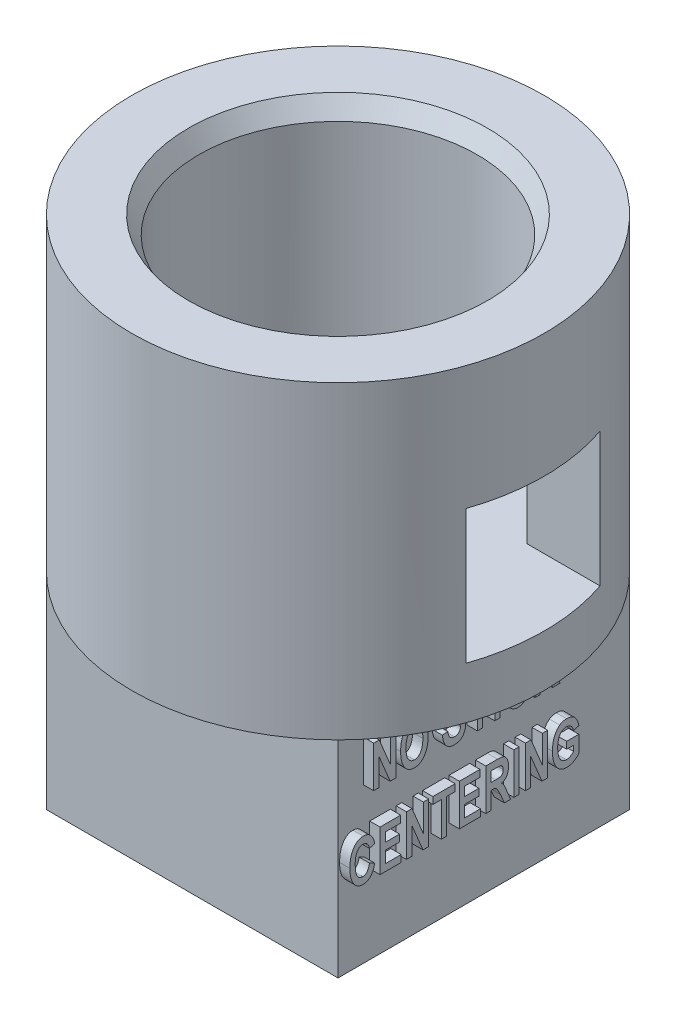
from build123d import *

# Parameters (mm, degrees)
SKETCH1_W           = 9.6
SKETCH1_H           = 9.6
BOSS_EXTRUDE1_DEPTH = 28
SKETCH2_R           = 20
BOSS_EXTRUDE2_DEPTH = 30
SKETCH3_R           = 13.5
CUT_EXTRUDE1_DEPTH  = 25
CHAMFER1_SIZE       = 1
CHAMFER1_SIZE2      = 1.732050808
CHAMFER2_SIZE       = 1
CHAMFER2_SIZE2      = 1.732050808
SKETCH4_W           = 28.284271248
SKETCH4_H           = 28.284271248
SKETCH4_W_2         = 15.5
SKETCH4_H_2         = 15.5
BOSS_EXTRUDE3_DEPTH = 20
SKETCH6_W           = 0.512820513
SKETCH6_H           = 4
BOSS_EXTRUDE4_DEPTH = 1
SKETCH7_W           = 0.512820513
SKETCH7_H           = 4
SKETCH7_W_2         = 0.512820512
BOSS_EXTRUDE5_DEPTH = 1
SKETCH8_W           = 13
SKETCH8_H           = 13
CUT_EXTRUDE2_DEPTH  = 13
CHAMFER3_SIZE       = 4
CHAMFER3_SIZE2      = 4.76701437


with BuildPart() as part:
    # Sketch1 → Boss-Extrude1 (new body)
    with BuildSketch(Plane(origin=(0, 0, 0), x_dir=(1, 0, 0), z_dir=(0, 1, 0))):
        Rectangle(SKETCH1_W, SKETCH1_H)
    extrude(amount=BOSS_EXTRUDE1_DEPTH)

    # Sketch2 → Boss-Extrude2 (add)
    with BuildSketch(Plane(origin=(0, 28, 0), x_dir=(1, 0, 0), z_dir=(0, 1, 0))):
        with Locations(Location((0, 0, 0), (0, 0, 270))):
            Circle(SKETCH2_R)
    extrude(amount=BOSS_EXTRUDE2_DEPTH)

    # Sketch3 → Cut-Extrude1 (cut)
    with BuildSketch(Plane(origin=(0, 58, 0), x_dir=(1, 0, 0), z_dir=(0, 1, 0))):
        with Locations(Location((0, 0, 0), (0, 0, 270))):
            Circle(SKETCH3_R)
    extrude(amount=-CUT_EXTRUDE1_DEPTH, mode=Mode.SUBTRACT)

    # Chamfer1
    chamfer1_edges = [part.edges().sort_by_distance(p)[0] for p in [
        (0, 0, -4.8),
        (4.8, 0, 0),
        (0, 0, 4.8),
        (-4.8, 0, 0),
    ]]
    chamfer1_side = [part.faces().sort_by_distance(p)[0] for p in [
        (0, 0, 0),
    ]]
    chamfer(chamfer1_edges, length=CHAMFER1_SIZE, length2=CHAMFER1_SIZE2, reference=chamfer1_side[0])

    # Chamfer2
    chamfer2_edges = [part.edges().sort_by_distance(p)[0] for p in [
        (0, 58, -13.5),
    ]]
    chamfer2_side = [part.faces().sort_by_distance(p)[0] for p in [
        (0, 58, -19.434314575),
    ]]
    chamfer(chamfer2_edges, length=CHAMFER2_SIZE, length2=CHAMFER2_SIZE2, reference=chamfer2_side[0])

    # Sketch4 → Boss-Extrude3 (add)
    with BuildSketch(Plane.XZ.offset(-28)):
        Rectangle(SKETCH4_W, SKETCH4_H)
        Rectangle(SKETCH4_W_2, SKETCH4_H_2, mode=Mode.SUBTRACT)
    extrude(amount=BOSS_EXTRUDE3_DEPTH)

    # Sketch6 → Boss-Extrude4 (add)
    # profile 1 of 17: a face of its own
    with BuildSketch(Plane.ZY.offset(14.142135624)):
        with BuildLine():
            Line((-13.731879213, 23), (-13.731879213, 27))
            Line((-13.731879213, 27), (-12.166975367, 27))
            add(Edge.make_bspline(
                [(-12.166975367, 27), (-12.130380711, 26.999683502), (-12.059561531, 26.999071005), (-11.956603045, 26.994622782), (-11.860481554, 26.985280074), (-11.770741867, 26.974872789), (-11.688133655, 26.959478422), (-11.612384649, 26.941151993), (-11.543249872, 26.919639161), (-11.479955452, 26.894635046), (-11.421207711, 26.865620395), (-11.366773597, 26.830808982), (-11.314941057, 26.791522348), (-11.267001504, 26.746098406), (-11.221205048, 26.696526658), (-11.178400334, 26.64170466), (-11.13947061, 26.581253664), (-11.090364142, 26.495089203), (-11.0387092, 26.379705404), (-10.994912914, 26.233175593), (-10.967457461, 26.079551034), (-10.964268956, 25.97474204), (-10.962648444, 25.921474359)],
                knots=[0, 0, 0, 0, 1.180324108, 2.284201946, 3.322286431, 4.29462867, 5.196901233, 6.030560013, 6.80706835, 7.530129348, 8.223590187, 8.91667637, 9.611046246, 10.318072396, 11.043592444, 11.786297711, 12.558060821, 13.36051314, 14.983922772, 16.621804664, 18.28308027, 20, 20, 20, 20], degree=3))
            add(Edge.make_bspline(
                [(-10.962648444, 25.921474359), (-10.963554621, 25.887266232), (-10.965342795, 25.819762753), (-10.975381522, 25.720501037), (-10.994095756, 25.625426647), (-11.019665311, 25.534509462), (-11.052669552, 25.447652565), (-11.092571515, 25.364855547), (-11.140650549, 25.28667452), (-11.194574713, 25.211825419), (-11.257430749, 25.143061299), (-11.327373833, 25.07961543), (-11.406550605, 25.024721958), (-11.493006786, 24.975640228), (-11.586860606, 24.93212743), (-11.689132294, 24.896225404), (-11.799430888, 24.867545002), (-11.876008957, 24.853416433), (-11.915372803, 24.846153846)],
                knots=[0, 0, 0, 0, 1.035001246, 2.042385546, 3.013742417, 3.962661506, 4.896042824, 5.821134124, 6.738465555, 7.669325541, 8.607416091, 9.551507097, 10.519902302, 11.515061601, 12.556225869, 13.644870113, 14.7893796, 16, 16, 16, 16], degree=3))
            add(Edge.make_bspline(
                [(-11.915372803, 24.846153846), (-11.885522403, 24.830216929), (-11.828666438, 24.799861932), (-11.750868698, 24.751134109), (-11.684483486, 24.702537613), (-11.646412831, 24.6677825), (-11.628513829, 24.651442308)],
                knots=[0, 0, 0, 0, 1.166995455, 2.222772637, 3.164432654, 4, 4, 4, 4], degree=3))
            add(Edge.make_bspline(
                [(-11.628513829, 24.651442308), (-11.593578755, 24.614688112), (-11.521588525, 24.538949243), (-11.42458336, 24.408707067), (-11.329232454, 24.264007383), (-11.272968414, 24.158618167), (-11.243898444, 24.104166667)],
                knots=[0, 0, 0, 0, 0.905527982, 1.866009172, 2.897429859, 4, 4, 4, 4], degree=3))
            Line((-11.243898444, 24.104166667), (-10.65255229, 23))
            Line((-10.65255229, 23), (-11.248706137, 23))
            Line((-11.248706137, 23), (-11.695821521, 23.844551282))
            add(Edge.make_bspline(
                [(-11.695821521, 23.844551282), (-11.711836078, 23.874204171), (-11.742902823, 23.931728006), (-11.788304274, 24.015367417), (-11.83279517, 24.092554397), (-11.873270753, 24.165627777), (-11.913657911, 24.232012427), (-11.950072889, 24.294306616), (-11.985749228, 24.350249732), (-12.027921837, 24.416671769), (-12.077528548, 24.489659737), (-12.135948602, 24.564249903), (-12.190222777, 24.625100218), (-12.258541162, 24.683264856), (-12.342766053, 24.738613869), (-12.415562636, 24.76414419), (-12.450629213, 24.776442308)],
                knots=[0, 0, 0, 0, 1.151361241, 2.233533264, 3.251027285, 4.194954736, 5.086954017, 5.905398939, 6.659843725, 7.353393472, 8.593603245, 9.672423153, 10.589460707, 11.372340066, 12.734239498, 14, 14, 14, 14], degree=3))
            add(Edge.make_bspline(
                [(-12.450629213, 24.776442308), (-12.465282289, 24.779368654), (-12.498375432, 24.78597764), (-12.555004083, 24.790521364), (-12.623366443, 24.795040619), (-12.673106312, 24.794930795), (-12.699827931, 24.794871795)],
                knots=[0, 0, 0, 0, 0.715768383, 1.616522439, 2.719530574, 4, 4, 4, 4], degree=3))
            Line((-12.699827931, 24.794871795), (-13.219058701, 24.794871795))
            Line((-13.219058701, 24.794871795), (-13.219058701, 23))
            Line((-13.219058701, 23), (-13.731879213, 23))
        make_face()
        with BuildLine():
            Line((-13.219058701, 25.256410256), (-12.256718957, 25.256410256))
            add(Edge.make_bspline(
                [(-12.256718957, 25.256410256), (-12.208606004, 25.257264552), (-12.118571581, 25.258863207), (-11.993019363, 25.272110154), (-11.886116267, 25.293757373), (-11.79574464, 25.324951872), (-11.719699561, 25.367869595), (-11.654554849, 25.421525795), (-11.599511285, 25.486571618), (-11.555346817, 25.561639042), (-11.519287301, 25.642807035), (-11.493914801, 25.728758058), (-11.477900853, 25.818044004), (-11.476287952, 25.878670412), (-11.475468957, 25.909455128)],
                knots=[0, 0, 0, 0, 1.479640641, 2.768871598, 3.877468672, 4.828571367, 5.696792412, 6.548848144, 7.411453614, 8.303335614, 9.219262273, 10.136808739, 11.053913723, 12, 12, 12, 12], degree=3))
            add(Edge.make_bspline(
                [(-11.475468957, 25.909455128), (-11.475812178, 25.931922761), (-11.476484611, 25.975940923), (-11.485229289, 26.040128535), (-11.496782854, 26.101676525), (-11.514196582, 26.160095619), (-11.53803937, 26.215069104), (-11.565897109, 26.267272832), (-11.598992701, 26.316339432), (-11.636698446, 26.362323101), (-11.679936896, 26.404524579), (-11.729982462, 26.440223439), (-11.785160986, 26.471295556), (-11.846617301, 26.495987101), (-11.9140691, 26.515100786), (-11.987366243, 26.528205259), (-12.066036563, 26.537664402), (-12.120470135, 26.538190294), (-12.14854588, 26.538461538)],
                knots=[0, 0, 0, 0, 1.027660944, 2.013373859, 2.960495112, 3.892662553, 4.796496922, 5.699090044, 6.597699653, 7.500954986, 8.417517152, 9.354163886, 10.306557675, 11.310080009, 12.378182552, 13.510020315, 14.715718406, 16, 16, 16, 16], degree=3))
            Line((-12.14854588, 26.538461538), (-13.219058701, 26.538461538))
            Line((-13.219058701, 26.538461538), (-13.219058701, 25.256410256))
        make_face(mode=Mode.SUBTRACT)
    # profile 2 of 17: a face of its own
    with BuildSketch(Plane.ZY.offset(14.142135624)):
        Polygon((-10.142135624, 23), (-10.142135624, 27), (-7.57803306, 27), (-7.57803306, 26.538461538), (-9.629315111, 26.538461538), (-9.629315111, 25.307692308), (-7.731879213, 25.307692308), (-7.731879213, 24.846153846), (-9.629315111, 24.846153846), (-9.629315111, 23.461538462), (-7.475468957, 23.461538462), (-7.475468957, 23), align=None)
    # profile 3 of 17: a face of its own
    with BuildSketch(Plane.ZY.offset(14.142135624)):
        with BuildLine():
            Line((-6.860084342, 23), (-6.860084342, 27))
            Line((-6.860084342, 27), (-6.093257419, 27))
            Line((-6.093257419, 27), (-5.301590752, 24.193108974))
            add(Edge.make_bspline(
                [(-5.301590752, 24.193108974), (-5.292691175, 24.16134828), (-5.275505185, 24.100015141), (-5.251993036, 24.010780641), (-5.228352028, 23.928509122), (-5.207274089, 23.852181084), (-5.189507991, 23.781615049), (-5.171339308, 23.717801146), (-5.15626843, 23.659728004), (-5.146682373, 23.623128627), (-5.142135624, 23.605769231)],
                knots=[0, 0, 0, 0, 1.300676304, 2.511738533, 3.638772616, 4.676163814, 5.634164497, 6.508050407, 7.292355584, 8, 8, 8, 8], degree=3))
            add(Edge.make_bspline(
                [(-5.142135624, 23.605769231), (-5.137352363, 23.62473903), (-5.127167793, 23.665129728), (-5.110565, 23.72876241), (-5.090970853, 23.79857014), (-5.070251257, 23.874723051), (-5.047744229, 23.95723587), (-5.023896086, 24.046302887), (-4.997389027, 24.141640225), (-4.978709605, 24.207275039), (-4.969058701, 24.241185897)],
                knots=[0, 0, 0, 0, 0.712931652, 1.517981605, 2.396414474, 3.355089217, 4.394009158, 5.513176905, 6.715158881, 8, 8, 8, 8], degree=3))
            Line((-4.969058701, 24.241185897), (-4.190212547, 27))
            Line((-4.190212547, 27), (-3.424186906, 27))
            Line((-3.424186906, 27), (-3.424186906, 23))
            Line((-3.424186906, 23), (-3.937007419, 23))
            Line((-3.937007419, 23), (-3.937007419, 26.384615385))
            Line((-3.937007419, 26.384615385), (-4.876911265, 23))
            Line((-4.876911265, 23), (-5.408161265, 23))
            Line((-5.408161265, 23), (-6.347263829, 26.384615385))
            Line((-6.347263829, 26.384615385), (-6.347263829, 23))
            Line((-6.347263829, 23), (-6.860084342, 23))
        make_face()
    # profile 4 of 17: a face of its own
    with BuildSketch(Plane.ZY.offset(14.142135624)):
        with BuildLine():
            add(Edge.make_bspline(
                [(-2.80880229, 24.947115385), (-2.807468467, 25.027289963), (-2.80487126, 25.183405161), (-2.783281291, 25.410860048), (-2.746305172, 25.624487116), (-2.696424548, 25.825308135), (-2.630617377, 26.012527729), (-2.550502784, 26.186634922), (-2.455332414, 26.347125131), (-2.346862555, 26.493778065), (-2.22561242, 26.623947242), (-2.096382405, 26.738968919), (-1.957642542, 26.835852706), (-1.81019876, 26.914751745), (-1.654501955, 26.976154588), (-1.490405163, 27.019122379), (-1.318002482, 27.046547128), (-1.199933857, 27.049683066), (-1.139731778, 27.051282051)],
                knots=[0, 0, 0, 0, 1.274097692, 2.480911245, 3.62686337, 4.71719691, 5.765766647, 6.776203283, 7.758323085, 8.726211193, 9.669441384, 10.580750943, 11.471045033, 12.352275481, 13.232810372, 14.124530334, 15.043715675, 16, 16, 16, 16], degree=3))
            add(Edge.make_bspline(
                [(-1.139731778, 27.051282051), (-1.099907807, 27.050508952), (-1.021144068, 27.048979917), (-0.90455102, 27.036898897), (-0.791096813, 27.015734463), (-0.680610261, 26.987252693), (-0.573181431, 26.949638726), (-0.468208663, 26.905474763), (-0.366939127, 26.850860932), (-0.268644033, 26.789741018), (-0.174977914, 26.720467317), (-0.08589889, 26.645480916), (-0.003070248, 26.563503656), (0.073113565, 26.474571039), (0.144729998, 26.380289759), (0.20981787, 26.278606461), (0.268789962, 26.170498481), (0.322475218, 26.056483555), (0.370463506, 25.937820317), (0.411254933, 25.814261075), (0.446405081, 25.687270974), (0.475744776, 25.556061195), (0.496616917, 25.420782537), (0.512959495, 25.281838031), (0.522723434, 25.139029339), (0.523923372, 25.042482711), (0.524531043, 24.993589744)],
                knots=[0, 0, 0, 0, 0.966523865, 1.911588243, 2.841114784, 3.765722261, 4.678088802, 5.601718424, 6.526893946, 7.467679169, 8.409067324, 9.352061412, 10.29184089, 11.234121568, 12.192325506, 13.163426325, 14.161506116, 15.179433539, 16.220791871, 17.266359438, 18.335911805, 19.418121576, 20.527658124, 21.656702398, 22.813311488, 24, 24, 24, 24], degree=3))
            add(Edge.make_bspline(
                [(0.524531043, 24.993589744), (0.524002028, 24.943890358), (0.522957012, 24.845714219), (0.512068519, 24.700797977), (0.495345334, 24.559874477), (0.472109507, 24.422950358), (0.442768922, 24.289588053), (0.405579802, 24.160527579), (0.362593583, 24.035096915), (0.312005956, 23.914645415), (0.256307529, 23.799360525), (0.194695544, 23.690600216), (0.126277941, 23.589835048), (0.053380828, 23.495488038), (-0.025396492, 23.408694065), (-0.10975394, 23.329088923), (-0.199770711, 23.256729937), (-0.294787615, 23.192162554), (-0.393600407, 23.135360087), (-0.494739977, 23.085477877), (-0.597792614, 23.043147093), (-0.702876464, 23.008016991), (-0.809961068, 22.982192084), (-0.918783734, 22.962452288), (-1.029718801, 22.9512146), (-1.104451427, 22.949554872), (-1.142135624, 22.948717949)],
                knots=[0, 0, 0, 0, 1.209807467, 2.389853036, 3.536013918, 4.663876702, 5.769837152, 6.858688728, 7.932188863, 8.996153267, 10.037338607, 11.047980843, 12.036347995, 13.000216837, 13.948561575, 14.887000136, 15.821329157, 16.757421618, 17.680961941, 18.594141893, 19.501048814, 20.391462789, 21.288877948, 22.180525842, 23.082523577, 24, 24, 24, 24], degree=3))
            add(Edge.make_bspline(
                [(-1.142135624, 22.948717949), (-1.182503666, 22.949404243), (-1.262646475, 22.950766746), (-1.38097731, 22.964185094), (-1.496259881, 22.984676761), (-1.608224141, 23.014628528), (-1.716979007, 23.052985155), (-1.822417004, 23.099812883), (-1.924691451, 23.154346861), (-2.022793754, 23.217636975), (-2.116515903, 23.288079374), (-2.204842411, 23.365251341), (-2.287641173, 23.44853026), (-2.363678096, 23.538723795), (-2.434264252, 23.634308372), (-2.499889543, 23.735553104), (-2.557756853, 23.844008286), (-2.610706337, 23.957342673), (-2.656474804, 24.074907729), (-2.697687065, 24.194234577), (-2.73226278, 24.315661824), (-2.760086372, 24.438744186), (-2.782048117, 24.563605031), (-2.79673536, 24.689908495), (-2.807070164, 24.817938902), (-2.808221814, 24.903825285), (-2.80880229, 24.947115385)],
                knots=[0, 0, 0, 0, 0.999232255, 1.98377917, 2.945059149, 3.896390443, 4.850247299, 5.79777763, 6.750556201, 7.717394396, 8.68565669, 9.651272558, 10.61935413, 11.590683551, 12.569549377, 13.5602306, 14.575272275, 15.610919321, 16.656089227, 17.697674641, 18.736063452, 19.780563512, 20.821140533, 21.873650616, 22.928236657, 24, 24, 24, 24], degree=3))
        make_face()
        with BuildLine():
            add(Edge.make_bspline(
                [(-2.295981778, 24.940705128), (-2.295263237, 24.882969729), (-2.293863084, 24.770466154), (-2.2770635, 24.606409735), (-2.251783997, 24.451640745), (-2.21715894, 24.305753409), (-2.170229205, 24.170055133), (-2.114404124, 24.043350321), (-2.047373346, 23.926386986), (-1.970821483, 23.819270113), (-1.886035648, 23.723654569), (-1.796342245, 23.639161575), (-1.699988336, 23.569343909), (-1.599385766, 23.510732783), (-1.492965507, 23.465766878), (-1.381378603, 23.433555115), (-1.264631466, 23.413814439), (-1.184947729, 23.411453607), (-1.14453947, 23.41025641)],
                knots=[0, 0, 0, 0, 1.292304231, 2.518192475, 3.688203032, 4.802214062, 5.870798834, 6.898850454, 7.898055377, 8.8838906, 9.841456472, 10.755527506, 11.63713118, 12.499849723, 13.357391098, 14.216682474, 15.095665435, 16, 16, 16, 16], degree=3))
            add(Edge.make_bspline(
                [(-1.14453947, 23.41025641), (-1.103336729, 23.411464269), (-1.022337028, 23.413838777), (-0.903566259, 23.433308009), (-0.790905592, 23.466683733), (-0.683089784, 23.511376064), (-0.582001224, 23.570797695), (-0.485537855, 23.641630832), (-0.395849539, 23.726670115), (-0.311611157, 23.823455715), (-0.235745704, 23.932577467), (-0.168759538, 24.052633701), (-0.112875194, 24.183828626), (-0.067377605, 24.325828435), (-0.031278331, 24.478505181), (-0.006170083, 24.642209812), (0.009330275, 24.816471886), (0.010902778, 24.936130709), (0.01171053, 24.997596154)],
                knots=[0, 0, 0, 0, 0.897469134, 1.764317854, 2.61332161, 3.453180069, 4.300666463, 5.162027503, 6.055506142, 6.987885588, 7.953370966, 8.945996531, 9.978413341, 11.055090065, 12.191456826, 13.393229137, 14.660973547, 16, 16, 16, 16], degree=3))
            add(Edge.make_bspline(
                [(0.01171053, 24.997596154), (0.010012223, 25.075118745), (0.006711188, 25.225801028), (-0.018575582, 25.444305031), (-0.062736252, 25.647363115), (-0.113783836, 25.805616051), (-0.163156677, 25.92327052), (-0.204227815, 26.005383076), (-0.249138555, 26.082502489), (-0.297877372, 26.154710493), (-0.351045196, 26.221827356), (-0.408902851, 26.283183203), (-0.46991201, 26.340538832), (-0.534732173, 26.39252198), (-0.602522304, 26.438862841), (-0.672818923, 26.479072294), (-0.744756066, 26.514091665), (-0.819705036, 26.540865757), (-0.896226631, 26.562709573), (-0.974610535, 26.579064768), (-1.055402205, 26.587685972), (-1.109799072, 26.589052184), (-1.137327931, 26.58974359)],
                knots=[0, 0, 0, 0, 2.115911222, 4.11274097, 5.993324997, 7.780215686, 8.642806296, 9.47426833, 10.284587078, 11.077297109, 11.850452832, 12.619057295, 13.377356604, 14.134568543, 14.884833599, 15.616444918, 16.343683582, 17.065640104, 17.785716576, 18.514962628, 19.248460668, 20, 20, 20, 20], degree=3))
            add(Edge.make_bspline(
                [(-1.137327931, 26.58974359), (-1.176135147, 26.588821566), (-1.253133316, 26.586992161), (-1.366172094, 26.567642958), (-1.475179458, 26.537961337), (-1.580324344, 26.497043902), (-1.680780792, 26.443001276), (-1.776484723, 26.376267685), (-1.869007788, 26.299345255), (-1.956766383, 26.210109882), (-2.038188642, 26.106979715), (-2.107429381, 25.986645176), (-2.165910559, 25.850707294), (-2.213580146, 25.699214627), (-2.251125894, 25.531979733), (-2.27666994, 25.34893389), (-2.292952534, 25.150133842), (-2.294945906, 25.012320776), (-2.295981778, 24.940705128)],
                knots=[0, 0, 0, 0, 0.819474858, 1.625936374, 2.416112125, 3.204410419, 4.005002645, 4.820794539, 5.666430121, 6.544618678, 7.46154083, 8.435524248, 9.469541593, 10.583534496, 11.787291839, 13.087757725, 14.486630308, 16, 16, 16, 16], degree=3))
        make_face(mode=Mode.SUBTRACT)
    # profile 5 of 17: a face of its own
    with BuildSketch(Plane.ZY.offset(14.142135624)):
        with BuildLine():
            Line((2.221646428, 23), (0.786550274, 27))
            Line((0.786550274, 27), (1.345043863, 27))
            Line((1.345043863, 27), (2.304979761, 24.133012821))
            add(Edge.make_bspline(
                [(2.304979761, 24.133012821), (2.323934987, 24.076471829), (2.361017528, 23.965859395), (2.411319748, 23.801348167), (2.458164896, 23.642920756), (2.485530955, 23.5382673), (2.498890017, 23.487179487)],
                knots=[0, 0, 0, 0, 1.060939515, 2.075540223, 3.060552378, 4, 4, 4, 4], degree=3))
            add(Edge.make_bspline(
                [(2.498890017, 23.487179487), (2.527505937, 23.595124122), (2.585068569, 23.8122612), (2.655152892, 24.025686787), (2.690396428, 24.133012821)],
                knots=[0, 0, 0, 0, 0.994253367, 2, 2, 2, 2], degree=3))
            Line((2.690396428, 24.133012821), (3.652736171, 27))
            Line((3.652736171, 27), (4.211229761, 27))
            Line((4.211229761, 27), (2.829819504, 23))
            Line((2.829819504, 23), (2.221646428, 23))
        make_face()
    # profile 6 of 17: a face of its own
    with BuildSketch(Plane.ZY.offset(14.142135624)):
        Polygon((4.575813094, 23), (4.575813094, 27), (7.139915658, 27), (7.139915658, 26.538461538), (5.088633607, 26.538461538), (5.088633607, 25.307692308), (6.986069504, 25.307692308), (6.986069504, 24.846153846), (5.088633607, 24.846153846), (5.088633607, 23.461538462), (7.242479761, 23.461538462), (7.242479761, 23), align=None)
    # profile 7 of 17: a face of its own
    with BuildSketch(Plane.ZY.offset(14.142135624)):
        Polygon((-11.45703947, 15.846153846), (-10.044379213, 19.846153846), (-9.469058701, 19.846153846), (-8.057199726, 15.846153846), (-8.603674085, 15.846153846), (-9.005116393, 17.076923077), (-10.509924085, 17.076923077), (-10.911366393, 15.846153846), align=None)
        with BuildLine():
            Line((-10.35928306, 17.538461538), (-9.155757419, 17.538461538))
            Line((-9.155757419, 17.538461538), (-9.494699726, 18.579326923))
            add(Edge.make_bspline(
                [(-9.494699726, 18.579326923), (-9.508096641, 18.620178554), (-9.534180044, 18.699715494), (-9.571564361, 18.816078451), (-9.607917801, 18.925670298), (-9.641404383, 19.02944472), (-9.673634853, 19.126788293), (-9.702955507, 19.218328586), (-9.731420818, 19.303306764), (-9.749026844, 19.358155556), (-9.757520239, 19.384615385)],
                knots=[0, 0, 0, 0, 1.218062451, 2.371532236, 3.462754579, 4.4893803, 5.460953514, 6.367932125, 7.212667493, 8, 8, 8, 8], degree=3))
            add(Edge.make_bspline(
                [(-9.757520239, 19.384615385), (-9.797006962, 19.263340586), (-9.87686917, 19.018061354), (-9.957261406, 18.772955328), (-9.997904855, 18.649038462)],
                knots=[0, 0, 0, 0, 0.988871312, 2, 2, 2, 2], degree=3))
            Line((-9.997904855, 18.649038462), (-10.35928306, 17.538461538))
        make_face(mode=Mode.SUBTRACT)
    # profile 8 of 17: a face of its own
    with BuildSketch(Plane.ZY.offset(14.142135624)):
        Polygon((-7.629315111, 15.846153846), (-7.629315111, 19.846153846), (-5.270340752, 19.846153846), (-5.270340752, 19.384615385), (-7.116494598, 19.384615385), (-7.116494598, 18.102564103), (-5.57803306, 18.102564103), (-5.57803306, 17.641025641), (-7.116494598, 17.641025641), (-7.116494598, 15.846153846), align=None)
    # profile 9 of 17: a face of its own
    with BuildSketch(Plane.ZY.offset(14.142135624)):
        Polygon((-3.731879213, 15.846153846), (-3.731879213, 19.384615385), (-4.911366393, 19.384615385), (-4.911366393, 19.846153846), (-2.039571521, 19.846153846), (-2.039571521, 19.384615385), (-3.219058701, 19.384615385), (-3.219058701, 15.846153846), align=None)
    # profile 10 of 17: a face of its own
    with BuildSketch(Plane.ZY.offset(14.142135624)):
        Polygon((-1.57803306, 15.846153846), (-1.57803306, 19.846153846), (0.986069504, 19.846153846), (0.986069504, 19.384615385), (-1.065212547, 19.384615385), (-1.065212547, 18.153846154), (0.832223351, 18.153846154), (0.832223351, 17.692307692), (-1.065212547, 17.692307692), (-1.065212547, 16.307692308), (1.088633607, 16.307692308), (1.088633607, 15.846153846), align=None)
    # profile 11 of 17: a face of its own
    with BuildSketch(Plane.ZY.offset(14.142135624)):
        with BuildLine():
            Line((1.755300274, 15.846153846), (1.755300274, 19.846153846))
            Line((1.755300274, 19.846153846), (3.32020412, 19.846153846))
            add(Edge.make_bspline(
                [(3.32020412, 19.846153846), (3.356798776, 19.845837348), (3.427617957, 19.845224851), (3.530576442, 19.840776628), (3.626697933, 19.831433921), (3.71643762, 19.821026635), (3.799045832, 19.805632268), (3.874794838, 19.787305839), (3.943929615, 19.765793007), (4.007224035, 19.740788892), (4.065971776, 19.711774241), (4.12040589, 19.676962828), (4.17223843, 19.637676195), (4.220177983, 19.592252252), (4.265974439, 19.542680504), (4.308779153, 19.487858506), (4.347708878, 19.42740751), (4.396815345, 19.341243049), (4.448470288, 19.22585925), (4.492266573, 19.079329439), (4.519722026, 18.92570488), (4.522910531, 18.820895886), (4.524531043, 18.767628205)],
                knots=[0, 0, 0, 0, 1.180324108, 2.284201946, 3.322286431, 4.29462867, 5.196901233, 6.030560013, 6.80706835, 7.530129348, 8.223590187, 8.91667637, 9.611046246, 10.318072396, 11.043592444, 11.786297711, 12.558060821, 13.36051314, 14.983922772, 16.621804664, 18.28308027, 20, 20, 20, 20], degree=3))
            add(Edge.make_bspline(
                [(4.524531043, 18.767628205), (4.523624866, 18.733420078), (4.521836692, 18.665916599), (4.511797965, 18.566654883), (4.493083731, 18.471580494), (4.467514176, 18.380663308), (4.434509935, 18.293806411), (4.394607973, 18.211009393), (4.346528938, 18.132828366), (4.292604774, 18.057979265), (4.229748738, 17.989215145), (4.159805654, 17.925769276), (4.080628883, 17.870875804), (3.994172702, 17.821794074), (3.900318881, 17.778281276), (3.798047193, 17.74237925), (3.687748599, 17.713698848), (3.611170531, 17.699570279), (3.571806684, 17.692307692)],
                knots=[0, 0, 0, 0, 1.035001246, 2.042385546, 3.013742417, 3.962661506, 4.896042824, 5.821134124, 6.738465555, 7.669325541, 8.607416091, 9.551507097, 10.519902302, 11.515061601, 12.556225869, 13.644870113, 14.7893796, 16, 16, 16, 16], degree=3))
            add(Edge.make_bspline(
                [(3.571806684, 17.692307692), (3.601657084, 17.676370775), (3.65851305, 17.646015778), (3.736310789, 17.597287955), (3.802696001, 17.548691459), (3.840766656, 17.513936346), (3.858665658, 17.497596154)],
                knots=[0, 0, 0, 0, 1.166995455, 2.222772637, 3.164432654, 4, 4, 4, 4], degree=3))
            add(Edge.make_bspline(
                [(3.858665658, 17.497596154), (3.893600732, 17.460841959), (3.965590963, 17.385103089), (4.062596127, 17.254860914), (4.157947033, 17.110161229), (4.214211073, 17.004772013), (4.243281043, 16.950320513)],
                knots=[0, 0, 0, 0, 0.905527982, 1.866009172, 2.897429859, 4, 4, 4, 4], degree=3))
            Line((4.243281043, 16.950320513), (4.834627197, 15.846153846))
            Line((4.834627197, 15.846153846), (4.238473351, 15.846153846))
            Line((4.238473351, 15.846153846), (3.791357966, 16.690705128))
            add(Edge.make_bspline(
                [(3.791357966, 16.690705128), (3.775343409, 16.720358017), (3.744276664, 16.777881853), (3.698875213, 16.861521263), (3.654384317, 16.938708243), (3.613908734, 17.011781623), (3.573521576, 17.078166273), (3.537106599, 17.140460463), (3.501430259, 17.196403578), (3.459257651, 17.262825616), (3.409650939, 17.335813583), (3.351230885, 17.410403749), (3.29695671, 17.471254065), (3.228638326, 17.529418702), (3.144413434, 17.584767715), (3.071616851, 17.610298036), (3.036550274, 17.622596154)],
                knots=[0, 0, 0, 0, 1.151361241, 2.233533264, 3.251027285, 4.194954736, 5.086954017, 5.905398939, 6.659843725, 7.353393472, 8.593603245, 9.672423153, 10.589460707, 11.372340066, 12.734239498, 14, 14, 14, 14], degree=3))
            add(Edge.make_bspline(
                [(3.036550274, 17.622596154), (3.021897198, 17.6255225), (2.988804056, 17.632131486), (2.932175404, 17.636675211), (2.863813044, 17.641194465), (2.814073175, 17.641084641), (2.787351556, 17.641025641)],
                knots=[0, 0, 0, 0, 0.715768383, 1.616522439, 2.719530574, 4, 4, 4, 4], degree=3))
            Line((2.787351556, 17.641025641), (2.268120787, 17.641025641))
            Line((2.268120787, 17.641025641), (2.268120787, 15.846153846))
            Line((2.268120787, 15.846153846), (1.755300274, 15.846153846))
        make_face()
        with BuildLine():
            Line((2.268120787, 18.102564103), (3.23046053, 18.102564103))
            add(Edge.make_bspline(
                [(3.23046053, 18.102564103), (3.278573484, 18.103418398), (3.368607906, 18.105017053), (3.494160125, 18.118264), (3.60106322, 18.139911219), (3.691434847, 18.171105718), (3.767479926, 18.214023441), (3.832624638, 18.267679641), (3.887668202, 18.332725464), (3.93183267, 18.407792888), (3.967892186, 18.488960881), (3.993264686, 18.574911904), (4.009278634, 18.66419785), (4.010891535, 18.724824259), (4.01171053, 18.755608974)],
                knots=[0, 0, 0, 0, 1.479640641, 2.768871598, 3.877468672, 4.828571367, 5.696792412, 6.548848144, 7.411453614, 8.303335614, 9.219262273, 10.136808739, 11.053913723, 12, 12, 12, 12], degree=3))
            add(Edge.make_bspline(
                [(4.01171053, 18.755608974), (4.011367309, 18.778076608), (4.010694877, 18.822094769), (4.001950198, 18.886282382), (3.990396633, 18.947830372), (3.972982905, 19.006249466), (3.949140117, 19.06122295), (3.921282378, 19.113426678), (3.888186786, 19.162493278), (3.850481041, 19.208476947), (3.807242591, 19.250678426), (3.757197025, 19.286377285), (3.702018501, 19.317449402), (3.640562186, 19.342140947), (3.573110387, 19.361254633), (3.499813244, 19.374359105), (3.421142925, 19.383818249), (3.366709352, 19.38434414), (3.338633607, 19.384615385)],
                knots=[0, 0, 0, 0, 1.027660944, 2.013373859, 2.960495112, 3.892662553, 4.796496922, 5.699090044, 6.597699653, 7.500954986, 8.417517152, 9.354163886, 10.306557675, 11.310080009, 12.378182552, 13.510020315, 14.715718406, 16, 16, 16, 16], degree=3))
            Line((3.338633607, 19.384615385), (2.268120787, 19.384615385))
            Line((2.268120787, 19.384615385), (2.268120787, 18.102564103))
        make_face(mode=Mode.SUBTRACT)
    # profile 12 of 17: a face of its own
    with BuildSketch(Plane.ZY.offset(14.142135624)):
        Polygon((-10.962648444, 8.692307692), (-10.962648444, 12.692307692), (-8.603674085, 12.692307692), (-8.603674085, 12.230769231), (-10.449827931, 12.230769231), (-10.449827931, 10.948717949), (-8.911366393, 10.948717949), (-8.911366393, 10.487179487), (-10.449827931, 10.487179487), (-10.449827931, 8.692307692), align=None)
    # profile 13 of 17: a face of its own
    with BuildSketch(Plane.ZY.offset(14.142135624)):
        Polygon((-7.937007419, 8.692307692), (-7.937007419, 12.692307692), (-7.424186906, 12.692307692), (-7.424186906, 9.153846154), (-5.731879213, 9.153846154), (-5.731879213, 8.692307692), align=None)
    # profile 14 of 17: a face of its own
    with BuildSketch(Plane.ZY.offset(14.142135624)):
        with Locations((-4.860084342, 10.692307692)):
            Rectangle(SKETCH6_W, SKETCH6_H)
    # profile 15 of 17: a face of its own
    with BuildSketch(Plane.ZY.offset(14.142135624)):
        with BuildLine():
            Line((-2.142135624, 10.282051282), (-2.142135624, 10.743589744))
            Line((-2.142135624, 10.743589744), (-0.654956137, 10.743589744))
            Line((-0.654956137, 10.743589744), (-0.654956137, 9.263621795))
            add(Edge.make_bspline(
                [(-0.654956137, 9.263621795), (-0.712482225, 9.214407579), (-0.82516403, 9.118007028), (-1.002581734, 8.99107681), (-1.183107488, 8.883839179), (-1.365853779, 8.794939657), (-1.551955547, 8.726448277), (-1.740569689, 8.677394131), (-1.93170672, 8.646391508), (-2.06029032, 8.642812877), (-2.124507419, 8.641025641)],
                knots=[0, 0, 0, 0, 1.112363294, 2.178891477, 3.201601167, 4.195413197, 5.161721217, 6.111061667, 7.05662823, 8, 8, 8, 8], degree=3))
            add(Edge.make_bspline(
                [(-2.124507419, 8.641025641), (-2.167539945, 8.641769652), (-2.252972593, 8.643246739), (-2.379246262, 8.655819703), (-2.502704889, 8.674774282), (-2.623143509, 8.702225321), (-2.740828516, 8.737127983), (-2.855086176, 8.781076963), (-2.966699589, 8.831316664), (-3.074832672, 8.889628589), (-3.177758678, 8.956068654), (-3.275296635, 9.029065762), (-3.366067868, 9.109523479), (-3.450294264, 9.196798076), (-3.527488114, 9.291471538), (-3.599173084, 9.392236404), (-3.662990472, 9.500896569), (-3.720624915, 9.615532445), (-3.771635886, 9.735203766), (-3.815693734, 9.859192651), (-3.853535069, 9.986429057), (-3.883654136, 10.117380698), (-3.908058027, 10.251283599), (-3.924435956, 10.38883882), (-3.935438674, 10.529734147), (-3.93648103, 10.62497854), (-3.937007419, 10.673076923)],
                knots=[0, 0, 0, 0, 1.009931783, 2.005021632, 2.976038321, 3.940372342, 4.902441252, 5.854962638, 6.811807606, 7.774060372, 8.735822777, 9.6850782, 10.631160269, 11.580084335, 12.528987688, 13.496191363, 14.480077752, 15.483899387, 16.506403338, 17.53169082, 18.571237996, 19.620627325, 20.684452155, 21.764650265, 22.871149201, 24, 24, 24, 24], degree=3))
            add(Edge.make_bspline(
                [(-3.937007419, 10.673076923), (-3.936484218, 10.720909194), (-3.935445314, 10.815888429), (-3.924266524, 10.957293233), (-3.908157917, 11.096482849), (-3.883292931, 11.232894687), (-3.854516572, 11.36727374), (-3.816205825, 11.498589902), (-3.77223507, 11.627794554), (-3.72200163, 11.753890979), (-3.666137206, 11.875171018), (-3.602102719, 11.988496385), (-3.533735907, 12.094468861), (-3.45851181, 12.192105361), (-3.377933332, 12.281934198), (-3.290832687, 12.363145693), (-3.198337968, 12.436639205), (-3.099672523, 12.501353572), (-2.995980015, 12.558063517), (-2.888567934, 12.608158805), (-2.776885161, 12.649401426), (-2.661741616, 12.684532837), (-2.542385072, 12.71036901), (-2.419638465, 12.729879742), (-2.292987995, 12.741161757), (-2.20732839, 12.742771291), (-2.163770239, 12.743589744)],
                knots=[0, 0, 0, 0, 1.119537342, 2.223034738, 3.318923678, 4.398330795, 5.467876783, 6.534622596, 7.598450614, 8.662039716, 9.711045232, 10.721647707, 11.706742524, 12.66099191, 13.6040102, 14.528605935, 15.445579817, 16.366468045, 17.28718643, 18.210406829, 19.138379324, 20.072085219, 21.026334605, 21.99471727, 22.980308081, 24, 24, 24, 24], degree=3))
            add(Edge.make_bspline(
                [(-2.163770239, 12.743589744), (-2.101186559, 12.741884009), (-1.978681136, 12.738545091), (-1.799341397, 12.712717282), (-1.629660818, 12.668428829), (-1.469859825, 12.607760248), (-1.323189711, 12.531510196), (-1.191050193, 12.44110082), (-1.07681229, 12.33568607), (-0.978757968, 12.215375291), (-0.895723459, 12.078621918), (-0.822756545, 11.924891812), (-0.761215965, 11.751817534), (-0.73029846, 11.628770368), (-0.714251008, 11.564903846)],
                knots=[0, 0, 0, 0, 1.098227559, 2.14974307, 3.171986082, 4.170640085, 5.143599391, 6.066905801, 6.972632281, 7.862248491, 8.782096857, 9.773960334, 10.84459418, 12, 12, 12, 12], degree=3))
            Line((-0.714251008, 11.564903846), (-1.18380229, 11.435096154))
            add(Edge.make_bspline(
                [(-1.18380229, 11.435096154), (-1.196780416, 11.482567904), (-1.221592898, 11.573327696), (-1.266990155, 11.699544191), (-1.316558417, 11.810154294), (-1.37218799, 11.905882453), (-1.437284978, 11.989577573), (-1.514120365, 12.062715464), (-1.603156032, 12.127156384), (-1.703162997, 12.181871608), (-1.81158095, 12.226770443), (-1.927252299, 12.258814546), (-2.048776683, 12.278527578), (-2.13191077, 12.280863432), (-2.174186906, 12.282051282)],
                knots=[0, 0, 0, 0, 1.239921697, 2.370568513, 3.376674919, 4.290999752, 5.154136589, 6.039661289, 6.955224205, 7.91632368, 8.906358951, 9.905891125, 10.935083876, 12, 12, 12, 12], degree=3))
            add(Edge.make_bspline(
                [(-2.174186906, 12.282051282), (-2.224195443, 12.280588735), (-2.32142389, 12.277745196), (-2.462141209, 12.258038343), (-2.592368888, 12.223571881), (-2.711559186, 12.175183296), (-2.819494702, 12.115543697), (-2.917858161, 12.048339179), (-3.003834276, 11.970620722), (-3.079419199, 11.885327491), (-3.144659332, 11.793489642), (-3.202861771, 11.697788405), (-3.252904801, 11.59719928), (-3.279962932, 11.527206075), (-3.293577931, 11.491987179)],
                knots=[0, 0, 0, 0, 1.222720381, 2.377258167, 3.465614428, 4.508621589, 5.514085473, 6.476103001, 7.414963019, 8.340254289, 9.257396317, 10.165776199, 11.077062754, 12, 12, 12, 12], degree=3))
            add(Edge.make_bspline(
                [(-3.293577931, 11.491987179), (-3.313740089, 11.429811589), (-3.354455114, 11.304255543), (-3.394008751, 11.107612652), (-3.420053885, 10.903484085), (-3.422794644, 10.764507927), (-3.424186906, 10.693910256)],
                knots=[0, 0, 0, 0, 0.964745127, 1.948185507, 2.95771098, 4, 4, 4, 4], degree=3))
            add(Edge.make_bspline(
                [(-3.424186906, 10.693910256), (-3.423719128, 10.65063353), (-3.422803107, 10.565887427), (-3.415805725, 10.44124241), (-3.402536053, 10.322116777), (-3.386409157, 10.208013613), (-3.363738146, 10.099748819), (-3.336498345, 9.996755426), (-3.304626296, 9.899006949), (-3.267773757, 9.806626047), (-3.226127301, 9.719807227), (-3.179695778, 9.638996223), (-3.129103548, 9.563756873), (-3.073300777, 9.4948901), (-3.014392984, 9.430350332), (-2.950007444, 9.372353289), (-2.880472928, 9.32125571), (-2.784178622, 9.259479762), (-2.656435116, 9.197827563), (-2.498031482, 9.142330563), (-2.334193971, 9.109339682), (-2.223476043, 9.104831869), (-2.167776649, 9.102564103)],
                knots=[0, 0, 0, 0, 1.133231707, 2.219136686, 3.26724247, 4.2712005, 5.23549321, 6.161776954, 7.059744315, 7.926019917, 8.764373853, 9.57896399, 10.364605659, 11.13576204, 11.897953964, 12.650717411, 13.400485681, 14.155228508, 15.644108947, 17.10171164, 18.54194432, 20, 20, 20, 20], degree=3))
            add(Edge.make_bspline(
                [(-2.167776649, 9.102564103), (-2.118800856, 9.104389743), (-2.021031024, 9.10803425), (-1.875405021, 9.13357637), (-1.732166192, 9.176632768), (-1.593798538, 9.234682619), (-1.464519814, 9.301695241), (-1.349686593, 9.372801392), (-1.249535192, 9.444089722), (-1.194160696, 9.498238451), (-1.167776649, 9.524038462)],
                knots=[0, 0, 0, 0, 1.058318157, 2.112708745, 3.18483881, 4.284769226, 5.351102266, 6.32833353, 7.203508316, 8, 8, 8, 8], degree=3))
            Line((-1.167776649, 9.524038462), (-1.167776649, 10.282051282))
            Line((-1.167776649, 10.282051282), (-2.142135624, 10.282051282))
        make_face()
    # profile 16 of 17: a face of its own
    with BuildSketch(Plane.ZY.offset(14.142135624)):
        Polygon((0.114274633, 8.692307692), (0.114274633, 12.692307692), (0.627095145, 12.692307692), (0.627095145, 11.051282051), (2.370684889, 11.051282051), (2.370684889, 12.692307692), (2.883505402, 12.692307692), (2.883505402, 8.692307692), (2.370684889, 8.692307692), (2.370684889, 10.58974359), (0.627095145, 10.58974359), (0.627095145, 8.692307692), align=None)
    # profile 17 of 17: a face of its own
    with BuildSketch(Plane.ZY.offset(14.142135624)):
        Polygon((4.575813094, 8.692307692), (4.575813094, 12.230769231), (3.396325915, 12.230769231), (3.396325915, 12.692307692), (6.268120787, 12.692307692), (6.268120787, 12.230769231), (5.088633607, 12.230769231), (5.088633607, 8.692307692), align=None)
    extrude(amount=BOSS_EXTRUDE4_DEPTH)

    # Sketch7 → Boss-Extrude5 (add)
    # profile 1 of 16: a face of its own
    with BuildSketch(Plane(origin=(14.142135624, 0, 0), x_dir=(0, 0, -1), z_dir=(1, 0, 0))):
        Polygon((-11.680597162, 23), (-11.680597162, 27), (-11.143738188, 27), (-10.039571521, 24.336538462), (-10.039571521, 27), (-9.526751008, 27), (-9.526751008, 23), (-10.080436906, 23), (-11.167776649, 25.625), (-11.167776649, 23), align=None)
    # profile 2 of 16: a face of its own
    with BuildSketch(Plane(origin=(14.142135624, 0, 0), x_dir=(0, 0, -1), z_dir=(1, 0, 0))):
        with BuildLine():
            add(Edge.make_bspline(
                [(-9.065212547, 24.975961538), (-9.065070797, 25.025383464), (-9.064792532, 25.122402517), (-9.057717776, 25.26478474), (-9.048604348, 25.401109944), (-9.034896596, 25.531261268), (-9.017503367, 25.655322745), (-8.995739848, 25.773449701), (-8.970646182, 25.885635779), (-8.949660344, 25.95762857), (-8.939411265, 25.992788462)],
                knots=[0, 0, 0, 0, 1.153421658, 2.264255705, 3.326731905, 4.342241836, 5.318250768, 6.250030243, 7.145348512, 8, 8, 8, 8], degree=3))
            add(Edge.make_bspline(
                [(-8.939411265, 25.992788462), (-8.923035696, 26.042465235), (-8.890842981, 26.140124759), (-8.830776422, 26.280341536), (-8.762923552, 26.412895241), (-8.686331961, 26.536247658), (-8.604406258, 26.648809558), (-8.516457152, 26.746000492), (-8.426414214, 26.82979066), (-8.36019027, 26.873167649), (-8.32803306, 26.894230769)],
                knots=[0, 0, 0, 0, 1.129302315, 2.220094386, 3.290840272, 4.342629798, 5.353370532, 6.292866535, 7.171045302, 8, 8, 8, 8], degree=3))
            add(Edge.make_bspline(
                [(-8.32803306, 26.894230769), (-8.284365829, 26.918677133), (-8.19652828, 26.967851506), (-8.050901977, 27.015274841), (-7.896680965, 27.046407211), (-7.790268856, 27.049633312), (-7.735885624, 27.051282051)],
                knots=[0, 0, 0, 0, 0.966213143, 1.943557983, 2.949029718, 4, 4, 4, 4], degree=3))
            add(Edge.make_bspline(
                [(-7.735885624, 27.051282051), (-7.686371713, 27.049510226), (-7.58911189, 27.046029843), (-7.447033641, 27.020922428), (-7.312630377, 26.978440995), (-7.186797532, 26.917214282), (-7.067637121, 26.840596228), (-6.956805221, 26.745929311), (-6.853781502, 26.634428058), (-6.75963926, 26.506430089), (-6.673725506, 26.364137469), (-6.600435881, 26.206956984), (-6.537949145, 26.037249372), (-6.486641927, 25.854242839), (-6.447120604, 25.657871642), (-6.418382154, 25.44835808), (-6.401588795, 25.225704398), (-6.399579264, 25.072945791), (-6.39854588, 24.994391026)],
                knots=[0, 0, 0, 0, 0.866250498, 1.701569716, 2.516071533, 3.325136817, 4.143238467, 4.988903395, 5.868692809, 6.794192213, 7.764948579, 8.77276288, 9.824245573, 10.926648675, 12.095427311, 13.326938422, 14.625401679, 16, 16, 16, 16], degree=3))
            add(Edge.make_bspline(
                [(-6.39854588, 24.994391026), (-6.399584506, 24.916371438), (-6.401603855, 24.764681737), (-6.41831673, 24.543610479), (-6.447284149, 24.336065568), (-6.485872273, 24.140892138), (-6.537295481, 23.959162767), (-6.598577389, 23.789620433), (-6.67231163, 23.633690253), (-6.757342876, 23.4916196), (-6.851124711, 23.3642261), (-6.953796803, 23.253531189), (-7.062878729, 23.158445946), (-7.181144039, 23.08162246), (-7.30704263, 23.021950942), (-7.440565828, 22.978982452), (-7.581906709, 22.953994194), (-7.678629351, 22.950497955), (-7.727872803, 22.948717949)],
                knots=[0, 0, 0, 0, 1.373200885, 2.669847877, 3.8992147, 5.060039711, 6.168860805, 7.220428846, 8.229860525, 9.199818206, 10.130705701, 11.008973049, 11.852411166, 12.671331043, 13.483080532, 14.297846829, 15.133399406, 16, 16, 16, 16], degree=3))
            add(Edge.make_bspline(
                [(-7.727872803, 22.948717949), (-7.77792299, 22.95046069), (-7.875721826, 22.953866034), (-8.018579118, 22.97914663), (-8.153333687, 23.021681283), (-8.280072477, 23.081961713), (-8.399941574, 23.157275648), (-8.510142977, 23.251952848), (-8.613204151, 23.362295715), (-8.707134686, 23.489224547), (-8.792514943, 23.630223804), (-8.864519415, 23.785817579), (-8.927773008, 23.952915957), (-8.977339123, 24.133400574), (-9.017847408, 24.325968299), (-9.044997049, 24.531421857), (-9.06227697, 24.749434265), (-9.064215243, 24.899003442), (-9.065212547, 24.975961538)],
                knots=[0, 0, 0, 0, 0.883746185, 1.726853635, 2.553445085, 3.372285738, 4.199442452, 5.046342838, 5.930881999, 6.861226236, 7.83051646, 8.83718082, 9.885203415, 10.982982739, 12.139555884, 13.358537861, 14.640883767, 16, 16, 16, 16], degree=3))
        make_face()
        with BuildLine():
            add(Edge.make_bspline(
                [(-8.552392034, 25.002403846), (-8.551524334, 24.947100919), (-8.549846024, 24.840133591), (-8.539761354, 24.684671277), (-8.521496191, 24.539635423), (-8.495757646, 24.404842051), (-8.464471439, 24.279915861), (-8.424001112, 24.165624856), (-8.377384535, 24.06111337), (-8.322431901, 23.967816197), (-8.262578094, 23.885129637), (-8.198019445, 23.813268089), (-8.130163326, 23.751591918), (-8.057028067, 23.702259954), (-7.980518021, 23.663652201), (-7.900286754, 23.634681059), (-7.815570835, 23.618827775), (-7.757847715, 23.616540579), (-7.728674085, 23.615384615)],
                knots=[0, 0, 0, 0, 1.479527355, 2.861712696, 4.165428394, 5.387436493, 6.531257147, 7.606964849, 8.62705544, 9.587838219, 10.498251885, 11.353343543, 12.168074797, 12.944953303, 13.705492822, 14.4557929, 15.219547962, 16, 16, 16, 16], degree=3))
            add(Edge.make_bspline(
                [(-7.728674085, 23.615384615), (-7.699484899, 23.616485757), (-7.641993476, 23.618654582), (-7.557593304, 23.635223586), (-7.477045346, 23.662252623), (-7.401104901, 23.701553084), (-7.329046429, 23.750841307), (-7.261411712, 23.811639597), (-7.198299892, 23.883547992), (-7.138580301, 23.965483989), (-7.085022501, 24.058997524), (-7.037722742, 24.16322476), (-6.998640812, 24.278759973), (-6.967222005, 24.404836058), (-6.941085011, 24.541443839), (-6.924539287, 24.689320033), (-6.912569784, 24.847826599), (-6.911775631, 24.957239657), (-6.911366393, 25.013621795)],
                knots=[0, 0, 0, 0, 0.776862044, 1.530118186, 2.281356855, 3.032056614, 3.799484329, 4.600425157, 5.446845274, 6.343136057, 7.295922157, 8.311320443, 9.386464809, 10.538803285, 11.769166971, 13.087192513, 14.49898801, 16, 16, 16, 16], degree=3))
            add(Edge.make_bspline(
                [(-6.911366393, 25.013621795), (-6.911878583, 25.069461679), (-6.912869626, 25.177507064), (-6.923370382, 25.333977549), (-6.940693745, 25.479550108), (-6.965299105, 25.613919114), (-6.996549687, 25.737707065), (-7.034279219, 25.850639591), (-7.080410482, 25.952379366), (-7.132332485, 26.043660776), (-7.190871722, 26.123612601), (-7.253692423, 26.193520617), (-7.321435091, 26.252558813), (-7.393728486, 26.301070821), (-7.470925009, 26.338417605), (-7.552598727, 26.36488954), (-7.639072535, 26.381395967), (-7.698418203, 26.383528279), (-7.728674085, 26.384615385)],
                knots=[0, 0, 0, 0, 1.502267837, 2.906759386, 4.217101583, 5.444827453, 6.579531745, 7.649944499, 8.64379779, 9.580646289, 10.470417747, 11.304802779, 12.104580982, 12.881927199, 13.640476208, 14.404080796, 15.186361122, 16, 16, 16, 16], degree=3))
            add(Edge.make_bspline(
                [(-7.728674085, 26.384615385), (-7.758931258, 26.38353081), (-7.818279458, 26.381403463), (-7.904734983, 26.364861185), (-7.986816651, 26.338411134), (-8.064388583, 26.300178019), (-8.13748684, 26.25121921), (-8.205262455, 26.19081576), (-8.268920658, 26.120460396), (-8.328193848, 26.039648368), (-8.381125486, 25.947413306), (-8.427704294, 25.844794798), (-8.465654939, 25.730708728), (-8.497771195, 25.606265839), (-8.522267568, 25.470722198), (-8.539338995, 25.324327684), (-8.551177859, 25.167127111), (-8.551978422, 25.058517262), (-8.552392034, 25.002403846)],
                knots=[0, 0, 0, 0, 0.807825706, 1.584516906, 2.3426658, 3.105334001, 3.887023623, 4.685786235, 5.524288759, 6.417674495, 7.357575912, 8.360271477, 9.423036497, 10.565229439, 11.791201076, 13.099264702, 14.501331431, 16, 16, 16, 16], degree=3))
        make_face(mode=Mode.SUBTRACT)
    # profile 3 of 16: a face of its own
    with BuildSketch(Plane(origin=(14.142135624, 0, 0), x_dir=(0, 0, -1), z_dir=(1, 0, 0))):
        with BuildLine():
            Line((-5.013930496, 24.333333333), (-4.501109983, 24.384615385))
            add(Edge.make_bspline(
                [(-4.501109983, 24.384615385), (-4.496267976, 24.352526088), (-4.486916168, 24.29054912), (-4.469533681, 24.201067025), (-4.448098709, 24.118279392), (-4.422165302, 24.042269794), (-4.394411842, 23.972170932), (-4.363270596, 23.90838145), (-4.328143619, 23.851439035), (-4.289396708, 23.801272868), (-4.247325776, 23.757335108), (-4.201437905, 23.719670788), (-4.152139851, 23.687192733), (-4.099219105, 23.660647709), (-4.042588563, 23.640711247), (-3.982735917, 23.626222134), (-3.919376735, 23.617316986), (-3.875871859, 23.616037471), (-3.853674085, 23.615384615)],
                knots=[0, 0, 0, 0, 1.394367125, 2.693067711, 3.915113478, 5.065597703, 6.141845995, 7.152973826, 8.111609543, 9.011492806, 9.871867054, 10.719750215, 11.556924489, 12.403797294, 13.256868702, 14.130912593, 15.046323489, 16, 16, 16, 16], degree=3))
            add(Edge.make_bspline(
                [(-3.853674085, 23.615384615), (-3.830139874, 23.615729742), (-3.784526416, 23.616398659), (-3.718645408, 23.624852178), (-3.656996026, 23.637157159), (-3.600240046, 23.656274949), (-3.546625317, 23.677637294), (-3.499140137, 23.707520336), (-3.455488107, 23.741187039), (-3.403662177, 23.792111471), (-3.35092206, 23.864272813), (-3.304366029, 23.958888135), (-3.274692351, 24.060730272), (-3.271808177, 24.131474384), (-3.270340752, 24.167467949)],
                knots=[0, 0, 0, 0, 0.936150819, 1.814425653, 2.64016237, 3.433647015, 4.195888338, 4.930721167, 5.658055111, 6.387329133, 7.816281959, 9.190432046, 10.570533083, 12, 12, 12, 12], degree=3))
            add(Edge.make_bspline(
                [(-3.270340752, 24.167467949), (-3.271247208, 24.190193421), (-3.273005993, 24.234287338), (-3.282643947, 24.29826679), (-3.30262912, 24.356128622), (-3.328223534, 24.41008603), (-3.364889347, 24.459237087), (-3.411692698, 24.504769652), (-3.469686711, 24.547142608), (-3.513846607, 24.570301645), (-3.537167675, 24.582532051)],
                knots=[0, 0, 0, 0, 1.038736708, 2.015446385, 2.941311494, 3.825153752, 4.732837411, 5.724892382, 6.798503962, 8, 8, 8, 8], degree=3))
            add(Edge.make_bspline(
                [(-3.537167675, 24.582532051), (-3.547010824, 24.587162598), (-3.568885058, 24.597452969), (-3.606596215, 24.612495392), (-3.651877767, 24.630955569), (-3.70543204, 24.651905451), (-3.767527199, 24.673803786), (-3.837044161, 24.700194704), (-3.915549295, 24.726530112), (-3.970164655, 24.746154653), (-3.998706137, 24.756410256)],
                knots=[0, 0, 0, 0, 0.529043754, 1.175683405, 1.974285243, 2.908043577, 3.972572957, 5.176975695, 6.524713665, 8, 8, 8, 8], degree=3))
            add(Edge.make_bspline(
                [(-3.998706137, 24.756410256), (-4.036014313, 24.769567132), (-4.108427211, 24.795103827), (-4.210864197, 24.839935848), (-4.305769525, 24.884917618), (-4.391415062, 24.933251455), (-4.469265287, 24.982534701), (-4.537113916, 25.035699268), (-4.59752156, 25.090079012), (-4.63182415, 25.129716224), (-4.64854588, 25.149038462)],
                knots=[0, 0, 0, 0, 1.235024878, 2.397108016, 3.490205021, 4.513473133, 5.466723997, 6.364377335, 7.202671236, 8, 8, 8, 8], degree=3))
            add(Edge.make_bspline(
                [(-4.64854588, 25.149038462), (-4.669697384, 25.176682598), (-4.711687429, 25.231561842), (-4.764293518, 25.32098843), (-4.810651823, 25.413786531), (-4.847023692, 25.512028824), (-4.876520378, 25.614231951), (-4.895641345, 25.721151851), (-4.909488179, 25.83217213), (-4.910732754, 25.9078069), (-4.911366393, 25.946314103)],
                knots=[0, 0, 0, 0, 0.974913195, 1.935401317, 2.903128853, 3.879363731, 4.867726216, 5.880987535, 6.921167569, 8, 8, 8, 8], degree=3))
            add(Edge.make_bspline(
                [(-4.911366393, 25.946314103), (-4.91011358, 25.996088528), (-4.907641867, 26.094289987), (-4.883933855, 26.238946293), (-4.847670236, 26.378888835), (-4.795448202, 26.512082794), (-4.731225812, 26.636250492), (-4.651144586, 26.745646579), (-4.557784657, 26.838965357), (-4.451958615, 26.916960387), (-4.332887334, 26.977071802), (-4.202585859, 27.020550789), (-4.06062409, 27.046464275), (-3.962224976, 27.049640426), (-3.911366393, 27.051282051)],
                knots=[0, 0, 0, 0, 1.065396521, 2.101952789, 3.131649669, 4.15691841, 5.160161121, 6.117952832, 7.048424927, 7.977612118, 8.921773497, 9.893324387, 10.911143287, 12, 12, 12, 12], degree=3))
            add(Edge.make_bspline(
                [(-3.911366393, 27.051282051), (-3.869648187, 27.050482799), (-3.788320872, 27.048924701), (-3.670575448, 27.033296246), (-3.560603283, 27.008875765), (-3.458823875, 26.973616278), (-3.3652122, 26.92738352), (-3.279027851, 26.872255748), (-3.201058878, 26.806614218), (-3.132508777, 26.730579154), (-3.0706388, 26.647205318), (-3.01667574, 26.556157034), (-2.971628972, 26.458080721), (-2.932177425, 26.354267171), (-2.903574817, 26.242786432), (-2.879661356, 26.12526387), (-2.865699046, 26.000569676), (-2.861983861, 25.915360882), (-2.860084342, 25.871794872)],
                knots=[0, 0, 0, 0, 1.119139028, 2.181699082, 3.181644734, 4.138386647, 5.064921363, 5.977625384, 6.878056863, 7.791380029, 8.719023373, 9.660769166, 10.626093574, 11.612795013, 12.637011764, 13.711116494, 14.829727329, 16, 16, 16, 16], degree=3))
            Line((-2.860084342, 25.871794872), (-3.372904855, 25.820512821))
            add(Edge.make_bspline(
                [(-3.372904855, 25.820512821), (-3.376066475, 25.844603442), (-3.382207842, 25.89139885), (-3.396267537, 25.958667224), (-3.411535763, 26.021037129), (-3.431208896, 26.077616452), (-3.452784108, 26.129053595), (-3.476441229, 26.17587289), (-3.503836383, 26.216842142), (-3.543548448, 26.264444129), (-3.603655873, 26.314026466), (-3.690936187, 26.35600514), (-3.793548874, 26.380988226), (-3.866878184, 26.383358607), (-3.905757419, 26.384615385)],
                knots=[0, 0, 0, 0, 1.001261793, 1.944925056, 2.831555525, 3.646358992, 4.411197608, 5.130199025, 5.805102627, 6.438107248, 7.681554389, 8.981581877, 10.399633296, 12, 12, 12, 12], degree=3))
            add(Edge.make_bspline(
                [(-3.905757419, 26.384615385), (-3.945986252, 26.383074637), (-4.023127465, 26.380120161), (-4.13209322, 26.353548379), (-4.228089131, 26.308764316), (-4.279991893, 26.264584003), (-4.305597162, 26.242788462)],
                knots=[0, 0, 0, 0, 1.10868346, 2.125967328, 3.075480597, 4, 4, 4, 4], degree=3))
            add(Edge.make_bspline(
                [(-4.305597162, 26.242788462), (-4.320078061, 26.227107047), (-4.349057028, 26.195725625), (-4.377556425, 26.136571554), (-4.395919737, 26.070829271), (-4.397649524, 26.024175484), (-4.39854588, 26)],
                knots=[0, 0, 0, 0, 0.954162814, 1.909456912, 2.91670335, 4, 4, 4, 4], degree=3))
            add(Edge.make_bspline(
                [(-4.39854588, 26), (-4.397408952, 25.977474076), (-4.395202289, 25.93375352), (-4.379695868, 25.870613946), (-4.353085799, 25.812522754), (-4.327375282, 25.778948421), (-4.314411265, 25.762019231)],
                knots=[0, 0, 0, 0, 1.048640802, 2.035306509, 3.009342373, 4, 4, 4, 4], degree=3))
            add(Edge.make_bspline(
                [(-4.314411265, 25.762019231), (-4.304270443, 25.751295417), (-4.282067332, 25.72781586), (-4.239607587, 25.696888179), (-4.189011302, 25.663415867), (-4.12799709, 25.631337372), (-4.05785182, 25.598442982), (-3.978187474, 25.564791873), (-3.888937008, 25.530565765), (-3.792347712, 25.497290615), (-3.69419909, 25.464423439), (-3.600826772, 25.429016042), (-3.513805177, 25.393909051), (-3.433948101, 25.357957155), (-3.360760123, 25.321790308), (-3.294298167, 25.286005899), (-3.234462953, 25.249904996), (-3.164074374, 25.200891907), (-3.08403173, 25.132979302), (-3.000636117, 25.037648555), (-2.927873743, 24.92877132), (-2.866045705, 24.806565384), (-2.816972906, 24.669652526), (-2.782208382, 24.518279718), (-2.76140264, 24.35180567), (-2.758850736, 24.235907228), (-2.757520239, 24.175480769)],
                knots=[0, 0, 0, 0, 0.436534464, 0.955782739, 1.550709021, 2.234181455, 2.995400767, 3.846561834, 4.796104741, 5.82739804, 6.87364714, 7.86299483, 8.786009037, 9.65393259, 10.457429111, 11.204695151, 11.890181032, 12.526915245, 13.745097574, 14.990009935, 16.26760376, 17.616209142, 19.038273161, 20.566461507, 22.20984158, 24, 24, 24, 24], degree=3))
            add(Edge.make_bspline(
                [(-2.757520239, 24.175480769), (-2.758931825, 24.119290965), (-2.761715565, 24.008481044), (-2.787780902, 23.844957155), (-2.82883706, 23.68678521), (-2.8783454, 23.560712104), (-2.923633886, 23.464143636), (-2.962382117, 23.396919988), (-3.003698109, 23.334199231), (-3.049468881, 23.276742303), (-3.097638886, 23.223154055), (-3.150211618, 23.174958841), (-3.205714332, 23.13120537), (-3.285362873, 23.079931606), (-3.394679953, 23.025960659), (-3.539734431, 22.980596414), (-3.699588194, 22.953108405), (-3.81109127, 22.950216971), (-3.868898444, 22.948717949)],
                knots=[0, 0, 0, 0, 1.437532714, 2.834907315, 4.228059825, 5.613421545, 6.2954403, 6.956962657, 7.597953206, 8.216259406, 8.835812001, 9.440663519, 10.039767731, 10.642877552, 11.862990263, 13.147485302, 14.521154566, 16, 16, 16, 16], degree=3))
            add(Edge.make_bspline(
                [(-3.868898444, 22.948717949), (-3.911428223, 22.949721556), (-3.994432521, 22.951680272), (-4.114901394, 22.969034065), (-4.228118014, 22.99593707), (-4.333696583, 23.034370971), (-4.431559018, 23.084577172), (-4.521973928, 23.14563874), (-4.604004949, 23.218658696), (-4.679159173, 23.301814281), (-4.746293099, 23.395809351), (-4.805637547, 23.500310231), (-4.858648318, 23.614391388), (-4.904040186, 23.738869302), (-4.942224039, 23.873413211), (-4.974437702, 24.017513069), (-4.998153963, 24.172045267), (-5.008568955, 24.278520752), (-5.013930496, 24.333333333)],
                knots=[0, 0, 0, 0, 1.013130191, 1.97730068, 2.894406593, 3.782533169, 4.648013874, 5.509623211, 6.375548598, 7.258940174, 8.175803036, 9.122499536, 10.119299228, 11.170588132, 12.276704441, 13.450485564, 14.687533864, 16, 16, 16, 16], degree=3))
        make_face()
    # profile 4 of 16: a face of its own
    with BuildSketch(Plane(origin=(14.142135624, 0, 0), x_dir=(0, 0, -1), z_dir=(1, 0, 0))):
        Polygon((-1.629315111, 23), (-1.629315111, 26.333333333), (-2.449827931, 26.333333333), (-2.449827931, 27), (-0.295981778, 27), (-0.295981778, 26.333333333), (-1.116494598, 26.333333333), (-1.116494598, 23), align=None)
    # profile 5 of 16: a face of its own
    with BuildSketch(Plane(origin=(14.142135624, 0, 0), x_dir=(0, 0, -1), z_dir=(1, 0, 0))):
        with Locations((0.319402838, 25)):
            Rectangle(SKETCH7_W, SKETCH7_H)
    # profile 6 of 16: a face of its own
    with BuildSketch(Plane(origin=(14.142135624, 0, 0), x_dir=(0, 0, -1), z_dir=(1, 0, 0))):
        with BuildLine():
            Line((2.934787453, 24.487179487), (3.447607966, 24.230769231))
            add(Edge.make_bspline(
                [(3.447607966, 24.230769231), (3.43686682, 24.180443686), (3.415953624, 24.082458982), (3.377472037, 23.941143246), (3.333767032, 23.809604241), (3.284079608, 23.688394938), (3.229480259, 23.577278242), (3.170308826, 23.475649691), (3.105456273, 23.384163593), (3.035380015, 23.302377659), (2.960105885, 23.23104003), (2.879794642, 23.169306696), (2.794908895, 23.117209519), (2.704903766, 23.074394182), (2.610307577, 23.040289091), (2.510134135, 23.017726905), (2.405602992, 23.002549661), (2.334148938, 23.000860191), (2.297768222, 23)],
                knots=[0, 0, 0, 0, 1.336599677, 2.602382613, 3.80258816, 4.935185247, 6.002637253, 7.016517959, 7.986846253, 8.91178142, 9.809966243, 10.675949485, 11.538702266, 12.392169872, 13.261233087, 14.144827246, 15.055441798, 16, 16, 16, 16], degree=3))
            add(Edge.make_bspline(
                [(2.297768222, 23), (2.252759903, 23.001329051), (2.164114858, 23.003946652), (2.034617172, 23.031068973), (1.911217166, 23.072669737), (1.793486105, 23.130757515), (1.68342074, 23.207493124), (1.57844688, 23.299302842), (1.480614424, 23.4088303), (1.388890487, 23.533416473), (1.305602272, 23.672765629), (1.233932958, 23.825450854), (1.172610317, 23.989953581), (1.123673648, 24.166784414), (1.083863429, 24.35561906), (1.057841444, 24.556850813), (1.040230395, 24.769985895), (1.03832885, 24.91609399), (1.037351556, 24.991185897)],
                knots=[0, 0, 0, 0, 0.823661933, 1.622223407, 2.413084274, 3.205397539, 4.018538012, 4.864748189, 5.755270355, 6.703776775, 7.695865107, 8.724788015, 9.790216295, 10.908855182, 12.083701173, 13.323335877, 14.624334858, 16, 16, 16, 16], degree=3))
            add(Edge.make_bspline(
                [(1.037351556, 24.991185897), (1.038372869, 25.070277079), (1.040362733, 25.224373398), (1.057352139, 25.448557604), (1.085000405, 25.659473528), (1.124195828, 25.856439107), (1.173112775, 26.040359817), (1.235503021, 26.209900077), (1.306661746, 26.367119716), (1.391183669, 26.508845662), (1.484047846, 26.635744053), (1.583944662, 26.747327498), (1.692159494, 26.840897784), (1.806937396, 26.918442716), (1.929563872, 26.977834509), (2.058764238, 27.020807882), (2.195289832, 27.046094951), (2.288581541, 27.049528424), (2.336229761, 27.051282051)],
                knots=[0, 0, 0, 0, 1.397210828, 2.72223831, 3.969596226, 5.153272186, 6.268272164, 7.328207593, 8.341691866, 9.312863614, 10.237833309, 11.116490528, 11.952857007, 12.759086038, 13.556860144, 14.352244047, 15.158417834, 16, 16, 16, 16], degree=3))
            add(Edge.make_bspline(
                [(2.336229761, 27.051282051), (2.377700271, 27.049787295), (2.459261861, 27.046847502), (2.578723807, 27.026888919), (2.691714712, 26.99171156), (2.799528774, 26.944447668), (2.90086502, 26.882119198), (2.995910368, 26.806078859), (3.08489393, 26.716477438), (3.137164641, 26.648580297), (3.16395412, 26.613782051)],
                knots=[0, 0, 0, 0, 1.02111128, 2.008257427, 2.97145199, 3.928361622, 4.899516606, 5.891710674, 6.919471877, 8, 8, 8, 8], degree=3))
            add(Edge.make_bspline(
                [(3.16395412, 26.613782051), (3.179489803, 26.591282091), (3.211481702, 26.544948985), (3.254564165, 26.469768176), (3.293387525, 26.387017985), (3.331864505, 26.298309541), (3.364485725, 26.201159162), (3.39600849, 26.097889759), (3.42428002, 25.98750003), (3.43967654, 25.911134249), (3.447607966, 25.871794872)],
                knots=[0, 0, 0, 0, 0.819616997, 1.687798568, 2.594041147, 3.559397099, 4.585150082, 5.664435991, 6.796848128, 8, 8, 8, 8], degree=3))
            Line((3.447607966, 25.871794872), (2.934787453, 25.717948718))
            add(Edge.make_bspline(
                [(2.934787453, 25.717948718), (2.924987746, 25.767211422), (2.906153164, 25.861892056), (2.856089963, 25.992906582), (2.793856706, 26.108819767), (2.728259609, 26.191579707), (2.669624394, 26.247859908), (2.624280163, 26.285071086), (2.57570161, 26.31574488), (2.524945828, 26.340255571), (2.472521835, 26.36130995), (2.417056293, 26.373941066), (2.359814106, 26.3837828), (2.320784324, 26.384335063), (2.300973351, 26.384615385)],
                knots=[0, 0, 0, 0, 1.795583874, 3.451029028, 5.000401246, 6.490957019, 7.207885467, 7.908360272, 8.58755639, 9.25903335, 9.925039938, 10.604639898, 11.291734689, 12, 12, 12, 12], degree=3))
            add(Edge.make_bspline(
                [(2.300973351, 26.384615385), (2.273644408, 26.383825075), (2.219877996, 26.382270237), (2.141697461, 26.365994947), (2.067006373, 26.3423934), (1.996584375, 26.307404318), (1.930883003, 26.261932422), (1.868335482, 26.207556766), (1.809996067, 26.143307466), (1.755865503, 26.068721317), (1.706759691, 25.983290789), (1.66431575, 25.885770768), (1.62968654, 25.775714632), (1.599913015, 25.654279262), (1.578258104, 25.520237147), (1.561145269, 25.374310784), (1.551956136, 25.215930231), (1.550779822, 25.106313862), (1.550172069, 25.049679487)],
                knots=[0, 0, 0, 0, 0.766068119, 1.507146974, 2.23266439, 2.960270743, 3.704755135, 4.470015668, 5.28199997, 6.135301103, 7.052237868, 8.0426475, 9.114345894, 10.287245241, 11.549412943, 12.923013523, 14.410244666, 16, 16, 16, 16], degree=3))
            add(Edge.make_bspline(
                [(1.550172069, 25.049679487), (1.550705395, 24.989565844), (1.551732493, 24.873796867), (1.561804401, 24.707035099), (1.576026972, 24.553362302), (1.598827887, 24.413308067), (1.625844847, 24.286013328), (1.66131472, 24.172796602), (1.701788873, 24.072365502), (1.749142281, 23.984955087), (1.802637012, 23.910240145), (1.858928244, 23.845169915), (1.919384437, 23.790183035), (1.983571721, 23.74490541), (2.051861443, 23.709904606), (2.123863482, 23.685053484), (2.199583147, 23.669131027), (2.251481714, 23.667494535), (2.277736171, 23.666666667)],
                knots=[0, 0, 0, 0, 1.658365525, 3.193738925, 4.608231667, 5.914270767, 7.106853679, 8.195349184, 9.18341923, 10.090328337, 10.930724968, 11.714097511, 12.460150837, 13.179785784, 13.875204038, 14.569723642, 15.276451511, 16, 16, 16, 16], degree=3))
            add(Edge.make_bspline(
                [(2.277736171, 23.666666667), (2.297258055, 23.667367562), (2.335964722, 23.668757251), (2.393176173, 23.6772796), (2.447828817, 23.693755947), (2.500332947, 23.7157023), (2.551430806, 23.742701215), (2.599227298, 23.777707338), (2.645389149, 23.818161407), (2.689440375, 23.864777129), (2.731402623, 23.917871072), (2.769855406, 23.978363418), (2.804845734, 24.046183792), (2.837858093, 24.120351374), (2.866448795, 24.202295213), (2.892736399, 24.290775558), (2.916138107, 24.386494289), (2.928442305, 24.452922923), (2.934787453, 24.487179487)],
                knots=[0, 0, 0, 0, 0.816387361, 1.618677433, 2.410170716, 3.196130671, 3.995540259, 4.819831759, 5.666510338, 6.559073302, 7.497336686, 8.491669169, 9.550558486, 10.68549764, 11.882829899, 13.175943878, 14.543663251, 16, 16, 16, 16], degree=3))
        make_face()
    # profile 7 of 16: a face of its own
    with BuildSketch(Plane(origin=(14.142135624, 0, 0), x_dir=(0, 0, -1), z_dir=(1, 0, 0))):
        Polygon((3.960428479, 23), (3.960428479, 27), (4.473248992, 27), (4.473248992, 25.178685897), (5.631902838, 27), (6.345043863, 27), (5.316998992, 25.465544872), (6.396325915, 23), (5.668761812, 23), (4.911550274, 24.858974359), (4.473248992, 24.205929487), (4.473248992, 23), align=None)
    # profile 8 of 16: a face of its own
    with BuildSketch(Plane(origin=(14.142135624, 0, 0), x_dir=(0, 0, -1), z_dir=(1, 0, 0))):
        with BuildLine():
            Line((-12.090853572, 17.128205128), (-11.57803306, 16.871794872))
            add(Edge.make_bspline(
                [(-11.57803306, 16.871794872), (-11.588774206, 16.821469327), (-11.609687402, 16.723484623), (-11.648168988, 16.582168887), (-11.691873993, 16.450629882), (-11.741561418, 16.329420579), (-11.796160767, 16.218303883), (-11.8553322, 16.116675332), (-11.920184753, 16.025189234), (-11.99026101, 15.9434033), (-12.06553514, 15.872065671), (-12.145846383, 15.810332337), (-12.23073213, 15.75823516), (-12.32073726, 15.715419823), (-12.415333449, 15.681314732), (-12.515506891, 15.658752546), (-12.620038034, 15.643575302), (-12.691492087, 15.641885832), (-12.727872803, 15.641025641)],
                knots=[0, 0, 0, 0, 1.336599677, 2.602382613, 3.80258816, 4.935185247, 6.002637253, 7.016517959, 7.986846253, 8.91178142, 9.809966243, 10.675949485, 11.538702266, 12.392169872, 13.261233087, 14.144827246, 15.055441798, 16, 16, 16, 16], degree=3))
            add(Edge.make_bspline(
                [(-12.727872803, 15.641025641), (-12.772881123, 15.642354692), (-12.861526168, 15.644972293), (-12.991023854, 15.672094614), (-13.11442386, 15.713695378), (-13.232154921, 15.771783156), (-13.342220285, 15.848518766), (-13.447194145, 15.940328483), (-13.545026602, 16.049855941), (-13.636750539, 16.174442114), (-13.720038754, 16.31379127), (-13.791708068, 16.466476495), (-13.853030709, 16.630979222), (-13.901967378, 16.807810055), (-13.941777597, 16.996644701), (-13.967799582, 17.197876454), (-13.985410631, 17.411011536), (-13.987312176, 17.557119631), (-13.98828947, 17.632211538)],
                knots=[0, 0, 0, 0, 0.823661933, 1.622223407, 2.413084274, 3.205397539, 4.018538012, 4.864748189, 5.755270355, 6.703776775, 7.695865107, 8.724788015, 9.790216295, 10.908855182, 12.083701173, 13.323335877, 14.624334858, 16, 16, 16, 16], degree=3))
            add(Edge.make_bspline(
                [(-13.98828947, 17.632211538), (-13.987268156, 17.71130272), (-13.985278293, 17.865399039), (-13.968288887, 18.089583245), (-13.94064062, 18.300499169), (-13.901445198, 18.497464748), (-13.85252825, 18.681385458), (-13.790138005, 18.850925718), (-13.718979279, 19.008145357), (-13.634457357, 19.149871303), (-13.54159318, 19.276769694), (-13.441696364, 19.388353139), (-13.333481531, 19.481923425), (-13.21870363, 19.559468357), (-13.096077154, 19.61886015), (-12.966876788, 19.661833523), (-12.830351194, 19.687120592), (-12.737059485, 19.690554065), (-12.689411265, 19.692307692)],
                knots=[0, 0, 0, 0, 1.397210828, 2.72223831, 3.969596226, 5.153272186, 6.268272164, 7.328207593, 8.341691866, 9.312863614, 10.237833309, 11.116490528, 11.952857007, 12.759086038, 13.556860144, 14.352244047, 15.158417834, 16, 16, 16, 16], degree=3))
            add(Edge.make_bspline(
                [(-12.689411265, 19.692307692), (-12.647940755, 19.690812936), (-12.566379164, 19.687873143), (-12.446917219, 19.66791456), (-12.333926314, 19.632737201), (-12.226112251, 19.585473309), (-12.124776006, 19.523144839), (-12.029730657, 19.4471045), (-11.940747095, 19.357503079), (-11.888476385, 19.289605938), (-11.861686906, 19.254807692)],
                knots=[0, 0, 0, 0, 1.02111128, 2.008257427, 2.97145199, 3.928361622, 4.899516606, 5.891710674, 6.919471877, 8, 8, 8, 8], degree=3))
            add(Edge.make_bspline(
                [(-11.861686906, 19.254807692), (-11.846151223, 19.232307732), (-11.814159324, 19.185974626), (-11.771076861, 19.110793817), (-11.732253501, 19.028043626), (-11.69377652, 18.939335182), (-11.661155301, 18.842184803), (-11.629632536, 18.7389154), (-11.601361006, 18.628525671), (-11.585964485, 18.55215989), (-11.57803306, 18.512820513)],
                knots=[0, 0, 0, 0, 0.819616997, 1.687798568, 2.594041147, 3.559397099, 4.585150082, 5.664435991, 6.796848128, 8, 8, 8, 8], degree=3))
            Line((-11.57803306, 18.512820513), (-12.090853572, 18.358974359))
            add(Edge.make_bspline(
                [(-12.090853572, 18.358974359), (-12.100653279, 18.408237063), (-12.119487862, 18.502917697), (-12.169551063, 18.633932223), (-12.231784319, 18.749845408), (-12.297381416, 18.832605348), (-12.356016631, 18.888885549), (-12.401360863, 18.926096727), (-12.449939415, 18.956770521), (-12.500695198, 18.981281212), (-12.553119191, 19.002335591), (-12.608584733, 19.014966707), (-12.665826919, 19.024808441), (-12.704856702, 19.025360704), (-12.724667675, 19.025641026)],
                knots=[0, 0, 0, 0, 1.795583874, 3.451029028, 5.000401246, 6.490957019, 7.207885467, 7.908360272, 8.58755639, 9.25903335, 9.925039938, 10.604639898, 11.291734689, 12, 12, 12, 12], degree=3))
            add(Edge.make_bspline(
                [(-12.724667675, 19.025641026), (-12.751996618, 19.024850716), (-12.80576303, 19.023295878), (-12.883943565, 19.007020588), (-12.958634653, 18.983419041), (-13.029056651, 18.948429959), (-13.094758023, 18.902958063), (-13.157305543, 18.848582408), (-13.215644958, 18.784333107), (-13.269775522, 18.709746958), (-13.318881335, 18.62431643), (-13.361325276, 18.526796409), (-13.395954485, 18.416740273), (-13.425728011, 18.295304903), (-13.447382922, 18.161262788), (-13.464495757, 18.015336425), (-13.47368489, 17.856955872), (-13.474861203, 17.747339503), (-13.475468957, 17.690705128)],
                knots=[0, 0, 0, 0, 0.766068119, 1.507146974, 2.23266439, 2.960270743, 3.704755135, 4.470015668, 5.28199997, 6.135301103, 7.052237868, 8.0426475, 9.114345894, 10.287245241, 11.549412943, 12.923013523, 14.410244666, 16, 16, 16, 16], degree=3))
            add(Edge.make_bspline(
                [(-13.475468957, 17.690705128), (-13.474935631, 17.630591486), (-13.473908532, 17.514822508), (-13.463836625, 17.34806074), (-13.449614054, 17.194387943), (-13.426813139, 17.054333708), (-13.399796179, 16.927038969), (-13.364326305, 16.813822243), (-13.323852152, 16.713391143), (-13.276498745, 16.625980728), (-13.223004014, 16.551265786), (-13.166712782, 16.486195556), (-13.106256588, 16.431208676), (-13.042069305, 16.385931051), (-12.973779582, 16.350930247), (-12.901777543, 16.326079125), (-12.826057878, 16.310156668), (-12.774159312, 16.308520176), (-12.747904855, 16.307692308)],
                knots=[0, 0, 0, 0, 1.658365525, 3.193738925, 4.608231667, 5.914270767, 7.106853679, 8.195349184, 9.18341923, 10.090328337, 10.930724968, 11.714097511, 12.460150837, 13.179785784, 13.875204038, 14.569723642, 15.276451511, 16, 16, 16, 16], degree=3))
            add(Edge.make_bspline(
                [(-12.747904855, 16.307692308), (-12.72838297, 16.308393203), (-12.689676304, 16.309782892), (-12.632464852, 16.318305241), (-12.577812208, 16.334781589), (-12.525308079, 16.356727941), (-12.47421022, 16.383726856), (-12.426413727, 16.418732979), (-12.380251877, 16.459187048), (-12.33620065, 16.50580277), (-12.294238402, 16.558896713), (-12.255785619, 16.619389059), (-12.220795292, 16.687209433), (-12.187782932, 16.761377015), (-12.15919223, 16.843320854), (-12.132904627, 16.931801199), (-12.109502919, 17.02751993), (-12.097198721, 17.093948564), (-12.090853572, 17.128205128)],
                knots=[0, 0, 0, 0, 0.816387361, 1.618677433, 2.410170716, 3.196130671, 3.995540259, 4.819831759, 5.666510338, 6.559073302, 7.497336686, 8.491669169, 9.550558486, 10.68549764, 11.882829899, 13.175943878, 14.543663251, 16, 16, 16, 16], degree=3))
        make_face()
    # profile 9 of 16: a face of its own
    with BuildSketch(Plane(origin=(14.142135624, 0, 0), x_dir=(0, 0, -1), z_dir=(1, 0, 0))):
        Polygon((-11.065212547, 15.641025641), (-11.065212547, 19.641025641), (-9.065212547, 19.641025641), (-9.065212547, 18.974358974), (-10.552392034, 18.974358974), (-10.552392034, 18.102564103), (-9.167776649, 18.102564103), (-9.167776649, 17.435897436), (-10.552392034, 17.435897436), (-10.552392034, 16.307692308), (-9.013930496, 16.307692308), (-9.013930496, 15.641025641), align=None)
    # profile 10 of 16: a face of its own
    with BuildSketch(Plane(origin=(14.142135624, 0, 0), x_dir=(0, 0, -1), z_dir=(1, 0, 0))):
        Polygon((-8.501109983, 15.641025641), (-8.501109983, 19.641025641), (-7.964251008, 19.641025641), (-6.860084342, 16.977564103), (-6.860084342, 19.641025641), (-6.347263829, 19.641025641), (-6.347263829, 15.641025641), (-6.900949726, 15.641025641), (-7.98828947, 18.266025641), (-7.98828947, 15.641025641), align=None)
    # profile 11 of 16: a face of its own
    with BuildSketch(Plane(origin=(14.142135624, 0, 0), x_dir=(0, 0, -1), z_dir=(1, 0, 0))):
        Polygon((-5.116494598, 15.641025641), (-5.116494598, 18.974358974), (-5.937007419, 18.974358974), (-5.937007419, 19.641025641), (-3.783161265, 19.641025641), (-3.783161265, 18.974358974), (-4.603674085, 18.974358974), (-4.603674085, 15.641025641), align=None)
    # profile 12 of 16: a face of its own
    with BuildSketch(Plane(origin=(14.142135624, 0, 0), x_dir=(0, 0, -1), z_dir=(1, 0, 0))):
        Polygon((-3.372904855, 15.641025641), (-3.372904855, 19.641025641), (-1.372904855, 19.641025641), (-1.372904855, 18.974358974), (-2.860084342, 18.974358974), (-2.860084342, 18.102564103), (-1.475468957, 18.102564103), (-1.475468957, 17.435897436), (-2.860084342, 17.435897436), (-2.860084342, 16.307692308), (-1.321622803, 16.307692308), (-1.321622803, 15.641025641), align=None)
    # profile 13 of 16: a face of its own
    with BuildSketch(Plane(origin=(14.142135624, 0, 0), x_dir=(0, 0, -1), z_dir=(1, 0, 0))):
        with BuildLine():
            Line((-0.80880229, 15.641025641), (-0.80880229, 19.641025641))
            Line((-0.80880229, 19.641025641), (0.337031043, 19.641025641))
            add(Edge.make_bspline(
                [(0.337031043, 19.641025641), (0.371756204, 19.64070983), (0.438838359, 19.640099745), (0.535930321, 19.635675979), (0.625391923, 19.626457811), (0.70792141, 19.615842708), (0.782826444, 19.600629404), (0.850426018, 19.582526939), (0.910423357, 19.560677124), (0.981345667, 19.527910407), (1.061586927, 19.472400611), (1.146190505, 19.386448314), (1.219186252, 19.278819707), (1.28247471, 19.153929758), (1.332941704, 19.013580888), (1.369641411, 18.861819777), (1.392624252, 18.70048793), (1.395073833, 18.589554965), (1.396325915, 18.532852564)],
                knots=[0, 0, 0, 0, 0.935970785, 1.808110771, 2.61826956, 3.359444085, 4.049827969, 4.676795923, 5.243868237, 5.768797617, 6.779137725, 7.853225778, 9.001493548, 10.269996143, 11.618175948, 13.011497765, 14.472453597, 16, 16, 16, 16], degree=3))
            add(Edge.make_bspline(
                [(1.396325915, 18.532852564), (1.395946465, 18.496513007), (1.395206105, 18.425609309), (1.387027114, 18.321518929), (1.373313673, 18.222328838), (1.355354717, 18.127697921), (1.331050473, 18.038035467), (1.301605614, 17.953411257), (1.266901437, 17.873264522), (1.2272187, 17.798356332), (1.182307243, 17.728850434), (1.131598588, 17.665947985), (1.075525017, 17.610052879), (1.014651871, 17.56014668), (0.948119753, 17.517852309), (0.87601859, 17.482450883), (0.798991854, 17.453373832), (0.745037496, 17.439657382), (0.717640017, 17.432692308)],
                knots=[0, 0, 0, 0, 1.238717345, 2.416915593, 3.556621696, 4.651350828, 5.698382519, 6.720731337, 7.70358902, 8.673110851, 9.607619014, 10.520628975, 11.422077042, 12.30239703, 13.199141617, 14.103207442, 15.03682788, 16, 16, 16, 16], degree=3))
            add(Edge.make_bspline(
                [(0.717640017, 17.432692308), (0.744019718, 17.406688235), (0.796206447, 17.355244609), (0.865759801, 17.270872615), (0.929448591, 17.183698145), (0.976984151, 17.106184717), (1.013427558, 17.038000441), (1.043868869, 16.978401308), (1.075611913, 16.909188984), (1.110013924, 16.831437231), (1.147231315, 16.744872841), (1.184963017, 16.648467053), (1.227163472, 16.543916465), (1.254658987, 16.470682071), (1.268922069, 16.432692308)],
                knots=[0, 0, 0, 0, 1.156045453, 2.286994515, 3.409825246, 4.525632584, 5.122747833, 5.824025839, 6.615134157, 7.500131262, 8.479251069, 9.557257789, 10.732846785, 12, 12, 12, 12], degree=3))
            Line((1.268922069, 16.432692308), (1.60145412, 15.641025641))
            Line((1.60145412, 15.641025641), (0.997287453, 15.641025641))
            Line((0.997287453, 15.641025641), (0.613473351, 16.532852564))
            add(Edge.make_bspline(
                [(0.613473351, 16.532852564), (0.595392684, 16.570019127), (0.560851914, 16.641021029), (0.510352138, 16.74157513), (0.464978801, 16.831617344), (0.423043323, 16.910138505), (0.386169909, 16.978238637), (0.354568977, 17.036084611), (0.326618293, 17.08250638), (0.296091593, 17.129008478), (0.260831452, 17.176270851), (0.216688717, 17.223352054), (0.170875127, 17.260599219), (0.122021181, 17.289767919), (0.065282018, 17.310206987), (-0.002890988, 17.324213106), (-0.084829222, 17.331330788), (-0.143993705, 17.33263333), (-0.17578947, 17.333333333)],
                knots=[0, 0, 0, 0, 1.630078954, 3.114054592, 4.437888611, 5.606566866, 6.624684374, 7.492333511, 8.205942395, 8.761065316, 9.68597695, 10.527987754, 11.299576852, 12.007800521, 12.761124135, 13.666084171, 14.7457232, 16, 16, 16, 16], degree=3))
            Line((-0.17578947, 17.333333333), (-0.295981778, 17.333333333))
            Line((-0.295981778, 17.333333333), (-0.295981778, 15.641025641))
            Line((-0.295981778, 15.641025641), (-0.80880229, 15.641025641))
        make_face()
        with BuildLine():
            Line((-0.295981778, 18), (0.135909248, 18))
            add(Edge.make_bspline(
                [(0.135909248, 18), (0.169299485, 18.000097342), (0.232617146, 18.000281931), (0.322880786, 18.00315735), (0.403372055, 18.00548796), (0.473848607, 18.011575711), (0.534332136, 18.017513463), (0.584925743, 18.025385485), (0.626083308, 18.034510194), (0.667785036, 18.049215285), (0.71038483, 18.074166511), (0.75556306, 18.110285282), (0.793008317, 18.156590753), (0.826745214, 18.209544098), (0.851257414, 18.271769027), (0.871474242, 18.340490606), (0.880829695, 18.416952328), (0.882592139, 18.470071074), (0.883505402, 18.497596154)],
                knots=[0, 0, 0, 0, 1.511504374, 2.866254695, 4.088468528, 5.155894674, 6.06791279, 6.839223467, 7.472738131, 7.973776109, 8.834664089, 9.693937131, 10.577951559, 11.517450048, 12.5257079, 13.593681795, 14.75309368, 16, 16, 16, 16], degree=3))
            add(Edge.make_bspline(
                [(0.883505402, 18.497596154), (0.882627079, 18.528359795), (0.880943731, 18.58731974), (0.867070094, 18.671205281), (0.841681286, 18.745246565), (0.808301478, 18.810580609), (0.764725652, 18.865280353), (0.713228628, 18.910045048), (0.652590299, 18.942719089), (0.608169166, 18.955166307), (0.585428479, 18.961538462)],
                knots=[0, 0, 0, 0, 1.229394877, 2.35619233, 3.382520486, 4.347137149, 5.274156787, 6.159996678, 7.058039764, 8, 8, 8, 8], degree=3))
            add(Edge.make_bspline(
                [(0.585428479, 18.961538462), (0.577961421, 18.962710023), (0.560431135, 18.965460477), (0.529341334, 18.967292544), (0.48957944, 18.970030765), (0.440660158, 18.971130367), (0.382984892, 18.973118291), (0.316462777, 18.973468126), (0.241147647, 18.974625149), (0.18799325, 18.974450908), (0.15994771, 18.974358974)],
                knots=[0, 0, 0, 0, 0.425675993, 0.999352376, 1.753201604, 2.671739974, 3.755752118, 5.004986058, 6.4197585, 8, 8, 8, 8], degree=3))
            Line((0.15994771, 18.974358974), (-0.295981778, 18.974358974))
            Line((-0.295981778, 18.974358974), (-0.295981778, 18))
        make_face(mode=Mode.SUBTRACT)
    # profile 14 of 16: a face of its own
    with BuildSketch(Plane(origin=(14.142135624, 0, 0), x_dir=(0, 0, -1), z_dir=(1, 0, 0))):
        with Locations((2.165556684, 17.641025641)):
            Rectangle(SKETCH7_W_2, SKETCH7_H)
    # profile 15 of 16: a face of its own
    with BuildSketch(Plane(origin=(14.142135624, 0, 0), x_dir=(0, 0, -1), z_dir=(1, 0, 0))):
        Polygon((3.037351556, 15.641025641), (3.037351556, 19.641025641), (3.57421053, 19.641025641), (4.678377197, 16.977564103), (4.678377197, 19.641025641), (5.19119771, 19.641025641), (5.19119771, 15.641025641), (4.637511812, 15.641025641), (3.550172069, 18.266025641), (3.550172069, 15.641025641), align=None)
    # profile 16 of 16: a face of its own
    with BuildSketch(Plane(origin=(14.142135624, 0, 0), x_dir=(0, 0, -1), z_dir=(1, 0, 0))):
        with BuildLine():
            Line((7.037351556, 17.128205128), (7.037351556, 17.794871795))
            Line((7.037351556, 17.794871795), (8.216838735, 17.794871795))
            Line((8.216838735, 17.794871795), (8.216838735, 16.1875))
            add(Edge.make_bspline(
                [(8.216838735, 16.1875), (8.18552632, 16.148117534), (8.121345202, 16.067395218), (8.002458745, 15.960488626), (7.866427489, 15.859045043), (7.713648231, 15.767113993), (7.550743863, 15.68949779), (7.38339419, 15.631289557), (7.214279296, 15.596455884), (7.100806229, 15.591968012), (7.044563094, 15.58974359)],
                knots=[0, 0, 0, 0, 0.887539232, 1.81919086, 2.813907595, 3.882941644, 4.963659245, 5.996300514, 7.006862653, 8, 8, 8, 8], degree=3))
            add(Edge.make_bspline(
                [(7.044563094, 15.58974359), (7.009276071, 15.590516746), (6.939561864, 15.592044218), (6.836795217, 15.604063763), (6.737433056, 15.625230978), (6.641576459, 15.654111556), (6.548668005, 15.689888756), (6.459851334, 15.735499879), (6.374532156, 15.789111516), (6.292343319, 15.850235443), (6.214680544, 15.918954057), (6.142648267, 15.995609), (6.074903828, 16.07842898), (6.012392886, 16.168537131), (5.954616883, 16.265760557), (5.902027451, 16.370061899), (5.853546672, 16.480872968), (5.797214365, 16.639178458), (5.739591468, 16.847250201), (5.688761197, 17.106741363), (5.6589104, 17.377239921), (5.654818445, 17.561091062), (5.652736171, 17.654647436)],
                knots=[0, 0, 0, 0, 0.760277245, 1.502028796, 2.225604492, 2.946680783, 3.657438596, 4.367870086, 5.094483869, 5.826593263, 6.572708621, 7.325894226, 8.090862707, 8.876405477, 9.686794069, 10.525920676, 11.392011214, 12.29138819, 14.144540757, 16.038614742, 17.984168936, 20, 20, 20, 20], degree=3))
            add(Edge.make_bspline(
                [(5.652736171, 17.654647436), (5.653483223, 17.705670218), (5.654954756, 17.806174269), (5.662671948, 17.954856979), (5.677240509, 18.098924646), (5.69721096, 18.238756508), (5.722849239, 18.374317655), (5.753923957, 18.505663757), (5.790933014, 18.632663962), (5.833147851, 18.754994677), (5.880788935, 18.871895334), (5.934909658, 18.981855346), (5.993031067, 19.085610797), (6.057119333, 19.181724731), (6.126520945, 19.270645781), (6.201351578, 19.35248246), (6.280860274, 19.42826461), (6.338747968, 19.47245681), (6.367479761, 19.494391026)],
                knots=[0, 0, 0, 0, 1.19728364, 2.358394634, 3.492103796, 4.593781934, 5.671745919, 6.728216914, 7.759535381, 8.77430684, 9.763560408, 10.719333165, 11.648264243, 12.552122088, 13.427188919, 14.292256722, 15.152384167, 16, 16, 16, 16], degree=3))
            add(Edge.make_bspline(
                [(6.367479761, 19.494391026), (6.390153666, 19.510355079), (6.435523592, 19.542298756), (6.509247133, 19.581877516), (6.586194428, 19.617172646), (6.668213057, 19.643622597), (6.75380013, 19.66555891), (6.843185806, 19.681725179), (6.93702135, 19.690308367), (7.00074354, 19.691631004), (7.033345145, 19.692307692)],
                knots=[0, 0, 0, 0, 0.94085264, 1.88262295, 2.836716987, 3.811918551, 4.804055956, 5.835984734, 6.89284454, 8, 8, 8, 8], degree=3))
            add(Edge.make_bspline(
                [(7.033345145, 19.692307692), (7.075320261, 19.69142308), (7.157126772, 19.689699032), (7.276550081, 19.675155556), (7.38875875, 19.650561996), (7.493973222, 19.615806708), (7.59219015, 19.571815064), (7.683288644, 19.517760713), (7.767551183, 19.454166087), (7.843319192, 19.379697054), (7.913357313, 19.297680274), (7.976727532, 19.207846882), (8.032787544, 19.109869739), (8.083546969, 19.005155771), (8.126262496, 18.892217848), (8.164309212, 18.772859113), (8.194768762, 18.645591932), (8.209363042, 18.557793764), (8.216838735, 18.512820513)],
                knots=[0, 0, 0, 0, 1.088102305, 2.12063392, 3.113693444, 4.061985733, 4.988791724, 5.898596886, 6.803088384, 7.718962222, 8.647422763, 9.596625024, 10.564739149, 11.571445742, 12.610644896, 13.692669295, 14.818105598, 16, 16, 16, 16], degree=3))
            Line((8.216838735, 18.512820513), (7.704018222, 18.358974359))
            add(Edge.make_bspline(
                [(7.704018222, 18.358974359), (7.692547961, 18.408255315), (7.670472105, 18.503102258), (7.616641865, 18.634295765), (7.549991719, 18.749563465), (7.482666, 18.832848998), (7.421915044, 18.88915755), (7.374210392, 18.92614845), (7.323234384, 18.956764631), (7.269706144, 18.98167449), (7.213842112, 19.002149996), (7.154773691, 19.015094564), (7.093495086, 19.024821878), (7.051549363, 19.025364214), (7.030140017, 19.025641026)],
                knots=[0, 0, 0, 0, 1.75856047, 3.384554586, 4.913408441, 6.379693309, 7.090030707, 7.79278639, 8.476662244, 9.154446672, 9.845361316, 10.542066631, 11.255862155, 12, 12, 12, 12], degree=3))
            add(Edge.make_bspline(
                [(7.030140017, 19.025641026), (6.997765579, 19.024474131), (6.934520489, 19.022194544), (6.842058792, 19.006944202), (6.755080236, 18.980400955), (6.673298398, 18.943048504), (6.596278042, 18.895449997), (6.525152794, 18.836203314), (6.457831298, 18.767772536), (6.397028646, 18.687963854), (6.342801978, 18.597735434), (6.294214451, 18.498013291), (6.254603298, 18.387421908), (6.221958744, 18.267075665), (6.19651382, 18.136650354), (6.178104231, 17.996177067), (6.168132202, 17.845230096), (6.166433526, 17.741199612), (6.165556684, 17.6875)],
                knots=[0, 0, 0, 0, 0.868638071, 1.696928083, 2.506273929, 3.301664489, 4.10313431, 4.928100027, 5.779538006, 6.674016435, 7.613064483, 8.600321656, 9.645526701, 10.759988253, 11.943451035, 13.20843456, 14.559018691, 16, 16, 16, 16], degree=3))
            add(Edge.make_bspline(
                [(6.165556684, 17.6875), (6.16643868, 17.629794754), (6.168151066, 17.517760725), (6.178079944, 17.35535322), (6.196410115, 17.204184171), (6.222215092, 17.064329021), (6.253460804, 16.934896368), (6.293409016, 16.816891244), (6.340883602, 16.710103917), (6.395210678, 16.614409209), (6.455983934, 16.530260272), (6.521585686, 16.457576545), (6.590350112, 16.394486193), (6.665838849, 16.345026586), (6.744669296, 16.305030571), (6.828280058, 16.2768409), (6.916438253, 16.259462061), (6.976907195, 16.257440063), (7.00770412, 16.256410256)],
                knots=[0, 0, 0, 0, 1.495806032, 2.904089083, 4.215349809, 5.440184204, 6.588700893, 7.663667079, 8.664658351, 9.613537284, 10.510909813, 11.349185754, 12.148355094, 12.922172643, 13.680726266, 14.433858069, 15.202361494, 16, 16, 16, 16], degree=3))
            add(Edge.make_bspline(
                [(7.00770412, 16.256410256), (7.039062667, 16.257618104), (7.102096243, 16.260045988), (7.196103508, 16.280894531), (7.29064619, 16.311680837), (7.382917102, 16.35728285), (7.472827594, 16.410141854), (7.556306032, 16.470502771), (7.634789715, 16.534483651), (7.68097373, 16.582574543), (7.704018222, 16.606570513)],
                knots=[0, 0, 0, 0, 0.939510804, 1.888503446, 2.876527833, 3.91568346, 4.968125747, 6.001863021, 7.002987216, 8, 8, 8, 8], degree=3))
            Line((7.704018222, 16.606570513), (7.704018222, 17.128205128))
            Line((7.704018222, 17.128205128), (7.037351556, 17.128205128))
        make_face()
    extrude(amount=BOSS_EXTRUDE5_DEPTH)

    # Sketch8 → Cut-Extrude2 (cut)
    with BuildSketch(Plane(origin=(0, 33, 0), x_dir=(1, 0, 0), z_dir=(0, 1, 0))):
        with Locations((13.5, 0)):
            Rectangle(SKETCH8_W, SKETCH8_H)
    extrude(amount=CUT_EXTRUDE2_DEPTH, mode=Mode.SUBTRACT)

    # Chamfer3
    chamfer3_edges = [part.edges().sort_by_distance(p)[0] for p in [
        (13.5, 46, 0),
    ]]
    chamfer3_side = [part.faces().sort_by_distance(p)[0] for p in [
        (16.289978934, 46, 0),
    ]]
    chamfer(chamfer3_edges, length=CHAMFER3_SIZE, length2=CHAMFER3_SIZE2, reference=chamfer3_side[0])


solid = part.part
